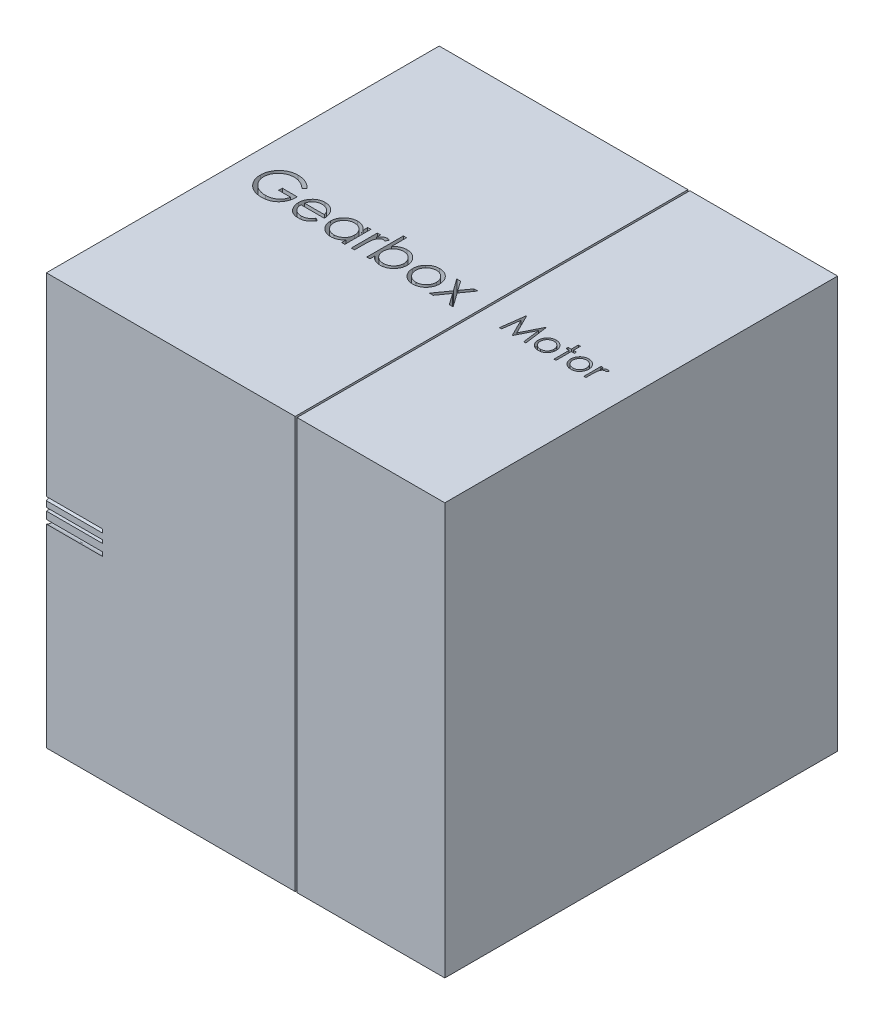
from build123d import *

# Parameters (mm, degrees)
BOSS_EXTRUDE1_DEPTH      = 110
BOSS_EXTRUDE1_DEPTH_BACK = 110
SKETCH1_W                = 213
SKETCH1_H                = 210
CUT_EXTRUDE1_DEPTH       = 30
SKETCH3_W                = 1.709615384
SKETCH3_H                = 19.538461539
SKETCH3_W_2              = 1.709615385
SKETCH3_H_2              = 13.921153846
CUT_EXTRUDE2_DEPTH       = 30
CUT_EXTRUDE3_DEPTH       = 267.021145938
CUT_EXTRUDE3_DEPTH_BACK  = 267.021145938
SKETCH4_W                = 1
SKETCH4_H                = 210
CUT_EXTRUDE4_DEPTH       = 30


with BuildPart() as part:
    # Sketch1 → Boss-Extrude1 (new, two sides: drawn at the far end of the back side and taken through both)
    with BuildSketch(Plane(origin=(0, 0, 0), x_dir=(1, 0, 0), z_dir=(0, 1, 0)).offset(-BOSS_EXTRUDE1_DEPTH_BACK)):
        Rectangle(SKETCH1_W, SKETCH1_H)
    extrude(amount=BOSS_EXTRUDE1_DEPTH + BOSS_EXTRUDE1_DEPTH_BACK)

    # Sketch2 → Cut-Extrude1 (cut)
    # profile 1 of 7: a face of its own
    with BuildSketch(Plane(origin=(0, 110, 0), x_dir=(1, 0, 0), z_dir=(0, 1, 0))):
        with BuildLine():
            Line((-75.784684127, 3.745099252), (-77.250068742, 2.356036752))
            add(Edge.make_bspline(
                [(-77.250068742, 2.356036752), (-77.51523869, 2.605487592), (-78.039255458, 3.098440974), (-78.893567636, 3.738036533), (-79.784909701, 4.285947736), (-80.708630577, 4.73175168), (-81.641854992, 5.087457419), (-82.572195902, 5.340703439), (-83.490110363, 5.502206822), (-84.100620509, 5.521520089), (-84.401450954, 5.531036752)],
                knots=[0, 0, 0, 0, 1.08915593, 2.152340314, 3.188132944, 4.216796309, 5.218260357, 6.173443236, 7.099959455, 8, 8, 8, 8], degree=3))
            add(Edge.make_bspline(
                [(-84.401450954, 5.531036752), (-84.586043821, 5.528785554), (-84.954750804, 5.524288997), (-85.502421671, 5.466898339), (-86.044348653, 5.384358151), (-86.579508736, 5.264931645), (-87.108942451, 5.113570907), (-87.63080845, 4.9242386), (-88.146080224, 4.703502199), (-88.649904179, 4.448436449), (-89.13834892, 4.168238999), (-89.599668268, 3.857731943), (-90.036802625, 3.526867244), (-90.441535797, 3.167361198), (-90.816195885, 2.782470288), (-91.169700595, 2.379354293), (-91.48961702, 1.946999747), (-91.778584646, 1.493361411), (-92.036367169, 1.02640678), (-92.263925698, 0.550630365), (-92.454954134, 0.067610243), (-92.606099312, -0.423259693), (-92.730798729, -0.918181904), (-92.818524562, -1.420583311), (-92.867982293, -1.931001856), (-92.876537267, -2.272798363), (-92.880837973, -2.444624306)],
                knots=[0, 0, 0, 0, 1.02818874, 2.053710826, 3.065248034, 4.081641283, 5.106893873, 6.131558223, 7.173050175, 8.228653731, 9.27666206, 10.308777013, 11.325269123, 12.329503258, 13.32196095, 14.316845687, 15.314881793, 16.315733098, 17.311955233, 18.285320748, 19.252783886, 20.203351036, 21.145449891, 22.095197417, 23.042428769, 24, 24, 24, 24], degree=3))
            add(Edge.make_bspline(
                [(-92.880837973, -2.444624306), (-92.876724706, -2.620269754), (-92.868509405, -2.971081021), (-92.815929666, -3.494651616), (-92.718348814, -4.010446164), (-92.587895999, -4.520159573), (-92.424714702, -5.024664794), (-92.22130062, -5.521774598), (-91.98036928, -6.011470584), (-91.701496047, -6.489340471), (-91.395682568, -6.954830069), (-91.05309237, -7.393304038), (-90.689179766, -7.81060124), (-90.290686968, -8.197456468), (-89.870392031, -8.564217389), (-89.415737786, -8.900779302), (-88.935664394, -9.21362506), (-88.429439426, -9.49881183), (-87.90255571, -9.753584002), (-87.362315383, -9.980136923), (-86.806992558, -10.166714459), (-86.239505633, -10.318777568), (-85.660531111, -10.443420614), (-85.067130128, -10.5236074), (-84.463665815, -10.581796065), (-84.056874118, -10.586050584), (-83.851931723, -10.588194018)],
                knots=[0, 0, 0, 0, 0.93586088, 1.869166235, 2.799637598, 3.729985548, 4.670839027, 5.622275134, 6.589130586, 7.576015415, 8.568469353, 9.55398029, 10.53834874, 11.515998671, 12.510579167, 13.508179873, 14.527009472, 15.561807829, 16.601455013, 17.643573243, 18.680854198, 19.719860599, 20.772568776, 21.833555941, 22.908541556, 24, 24, 24, 24], degree=3))
            add(Edge.make_bspline(
                [(-83.851931723, -10.588194018), (-83.604943862, -10.583031052), (-83.119943069, -10.572892731), (-82.407002573, -10.493969727), (-81.722274431, -10.370706465), (-81.067682668, -10.190189227), (-80.442466998, -9.959936367), (-79.844335417, -9.682375764), (-79.277997104, -9.3468614), (-78.741749545, -8.96818078), (-78.24777115, -8.54627862), (-77.802250846, -8.0910138), (-77.412294683, -7.60459618), (-77.072090534, -7.089890678), (-76.790647715, -6.542636947), (-76.559637645, -5.965516857), (-76.382563586, -5.358270828), (-76.309874366, -4.938672089), (-76.273145665, -4.726655556)],
                knots=[0, 0, 0, 0, 1.13008108, 2.219097802, 3.278683437, 4.311054135, 5.322181354, 6.324827112, 7.324222904, 8.330512327, 9.32562643, 10.293043162, 11.24128371, 12.174520618, 13.111833804, 14.052305215, 15.015860969, 16, 16, 16, 16], degree=3))
            Line((-76.273145665, -4.726655556), (-82.623145665, -4.726655556))
            Line((-82.623145665, -4.726655556), (-82.623145665, -2.772809402))
            Line((-82.623145665, -2.772809402), (-74.563530281, -2.772809402))
            add(Edge.make_bspline(
                [(-74.563530281, -2.772809402), (-74.57281497, -3.136977306), (-74.590986783, -3.849719676), (-74.718452596, -4.889143579), (-74.92428247, -5.870880938), (-75.205462167, -6.795965657), (-75.569454764, -7.663086783), (-76.012353812, -8.473124711), (-76.541247785, -9.22084636), (-77.137297474, -9.912355937), (-77.806224387, -10.529190649), (-78.52995359, -11.07133154), (-79.309680803, -11.528001489), (-80.14466847, -11.899534523), (-81.032183115, -12.189497267), (-81.974278439, -12.395082563), (-82.969676866, -12.51825422), (-83.651866493, -12.533991585), (-84.000759848, -12.542040172)],
                knots=[0, 0, 0, 0, 1.140356446, 2.231883559, 3.274166699, 4.278491846, 5.25512956, 6.21435461, 7.1637429, 8.11826594, 9.068280886, 10.0076534, 10.945064095, 11.891975133, 12.864533718, 13.863980011, 14.907571808, 16, 16, 16, 16], degree=3))
            add(Edge.make_bspline(
                [(-84.000759848, -12.542040172), (-84.215807871, -12.538942526), (-84.63995188, -12.532832971), (-85.26637536, -12.489413408), (-85.87552698, -12.422571986), (-86.467318, -12.321633528), (-87.043925262, -12.19800091), (-87.602469003, -12.039686055), (-88.145076914, -11.856432135), (-88.672587664, -11.647994255), (-89.180213269, -11.406485666), (-89.67021474, -11.138100343), (-90.145300652, -10.844222193), (-90.60223485, -10.519768876), (-91.043398133, -10.1671672), (-91.465945876, -9.785710441), (-91.872243612, -9.376564775), (-92.126754135, -9.086030451), (-92.254996627, -8.939636325)],
                knots=[0, 0, 0, 0, 1.107784379, 2.184907829, 3.233506516, 4.263428166, 5.276301166, 6.270063455, 7.25232949, 8.225834625, 9.190232166, 10.146266622, 11.1027726, 12.066435141, 13.031522626, 14.010570082, 14.99756817, 16, 16, 16, 16], degree=3))
            add(Edge.make_bspline(
                [(-92.254996627, -8.939636325), (-92.441065771, -8.707386057), (-92.810115502, -8.246740635), (-93.285158041, -7.508689509), (-93.690114247, -6.744502241), (-94.018687679, -5.952051478), (-94.275253549, -5.132078448), (-94.459256153, -4.285630935), (-94.567064399, -3.411618946), (-94.582595796, -2.820169434), (-94.590453358, -2.520946422)],
                knots=[0, 0, 0, 0, 1.023165419, 2.029347347, 3.013907458, 3.994755782, 4.975994455, 5.96558838, 6.970761222, 8, 8, 8, 8], degree=3))
            add(Edge.make_bspline(
                [(-94.590453358, -2.520946422), (-94.587556462, -2.296884389), (-94.581799487, -1.851608016), (-94.511992035, -1.190533242), (-94.411835745, -0.541196618), (-94.264622491, 0.095871067), (-94.079041393, 0.721095288), (-93.847428848, 1.334766348), (-93.577763057, 1.937246393), (-93.264333428, 2.524388445), (-92.91553087, 3.088401321), (-92.536978956, 3.627014508), (-92.123302218, 4.130419276), (-91.681256223, 4.604990961), (-91.205566891, 5.044767543), (-90.700690599, 5.453820631), (-90.166238262, 5.832698928), (-89.600528482, 6.175434743), (-89.012004942, 6.483302448), (-88.402078363, 6.753209444), (-87.770934931, 6.976275775), (-87.123303088, 7.16554449), (-86.454280692, 7.305508326), (-85.768722698, 7.407010783), (-85.06305566, 7.476464904), (-84.586065272, 7.482050668), (-84.344209367, 7.484882905)],
                knots=[0, 0, 0, 0, 1.008945113, 2.00506715, 2.99143336, 3.967273523, 4.948097931, 5.927297278, 6.919902385, 7.919676788, 8.923139349, 9.905703106, 10.883022732, 11.856032218, 12.825136022, 13.798837087, 14.781400844, 15.773989409, 16.776158564, 17.77167057, 18.775803737, 19.789618931, 20.80898985, 21.851988756, 22.910860228, 24, 24, 24, 24], degree=3))
            add(Edge.make_bspline(
                [(-84.344209367, 7.484882905), (-84.146969784, 7.481728815), (-83.755866868, 7.475474623), (-83.173885382, 7.432124182), (-82.600899403, 7.3634142), (-82.036059338, 7.269651262), (-81.481288687, 7.141941746), (-80.935007048, 6.989115654), (-80.396422529, 6.811178734), (-79.867223059, 6.598968013), (-79.343850347, 6.358101855), (-78.82339433, 6.086974513), (-78.307633291, 5.780949845), (-77.795672806, 5.439119173), (-77.284284494, 5.067353427), (-76.78155694, 4.655019858), (-76.275355201, 4.218378859), (-75.949862469, 3.904422972), (-75.784684127, 3.745099252)],
                knots=[0, 0, 0, 0, 0.985871117, 1.954866573, 2.915460327, 3.869826059, 4.81536089, 5.759505086, 6.70452669, 7.649098992, 8.607881297, 9.583363685, 10.581137262, 11.603961102, 12.659522466, 13.73993555, 14.853081303, 16, 16, 16, 16], degree=3))
        make_face()
    # profile 2 of 7: a face of its own
    with BuildSketch(Plane(origin=(0, 110, 0), x_dir=(1, 0, 0), z_dir=(0, 1, 0))):
        with BuildLine():
            Line((-59.718878838, -7.657424787), (-58.200068742, -8.454990893))
            add(Edge.make_bspline(
                [(-58.200068742, -8.454990893), (-58.321099354, -8.66967531), (-58.556576994, -9.08736617), (-58.961529636, -9.661216725), (-59.386029345, -10.177459292), (-59.849238086, -10.622302125), (-60.337297338, -11.010113234), (-60.852913645, -11.349409109), (-61.398771353, -11.638525627), (-61.974896283, -11.882107243), (-62.586126697, -12.069393204), (-63.233943808, -12.201677606), (-63.919588662, -12.283447111), (-64.389558584, -12.292945663), (-64.630206963, -12.297809402)],
                knots=[0, 0, 0, 0, 1.120438281, 2.179929193, 3.190490725, 4.156257408, 5.095198341, 6.022838206, 6.959905092, 7.901321166, 8.864066838, 9.862729781, 10.905609505, 12, 12, 12, 12], degree=3))
            add(Edge.make_bspline(
                [(-64.630206963, -12.297809402), (-64.897679727, -12.291565491), (-65.419441601, -12.279385429), (-66.17893651, -12.174379301), (-66.894015916, -12.003079748), (-67.564639616, -11.763781587), (-68.189165305, -11.451212866), (-68.768834243, -11.0704334), (-69.306694805, -10.623399271), (-69.785798001, -10.106238343), (-70.217111134, -9.552797976), (-70.597707383, -8.976095233), (-70.915882829, -8.377581111), (-71.174704893, -7.76106583), (-71.383737087, -7.13043521), (-71.529424432, -6.479951365), (-71.613406346, -5.811374828), (-71.626275685, -5.359087901), (-71.63276105, -5.131162768)],
                knots=[0, 0, 0, 0, 1.145258523, 2.234067595, 3.276747158, 4.290159414, 5.277019952, 6.260822364, 7.254936242, 8.264827045, 9.274100331, 10.257902744, 11.220704747, 12.172965371, 13.118907548, 14.062713208, 15.023725156, 16, 16, 16, 16], degree=3))
            add(Edge.make_bspline(
                [(-71.63276105, -5.131162768), (-71.626996295, -4.917286619), (-71.615571312, -4.493412337), (-71.543558026, -3.866038445), (-71.415932317, -3.256283582), (-71.240801182, -2.663641086), (-71.014643685, -2.089103243), (-70.737971178, -1.532320382), (-70.410352664, -0.993884978), (-70.15740854, -0.654233636), (-70.029996627, -0.483145941)],
                knots=[0, 0, 0, 0, 1.024358464, 2.0301432, 3.019427413, 4.004406732, 4.986367066, 5.972626655, 6.978780325, 8, 8, 8, 8], degree=3))
            add(Edge.make_bspline(
                [(-70.029996627, -0.483145941), (-69.857416239, -0.277031091), (-69.517722373, 0.128669414), (-68.94319421, 0.66173373), (-68.32107457, 1.108286278), (-67.659159862, 1.478439404), (-66.949757053, 1.759691683), (-66.202402198, 1.969282952), (-65.408585507, 2.086728983), (-64.865904234, 2.103317906), (-64.5882298, 2.111805982)],
                knots=[0, 0, 0, 0, 1.030682036, 2.02871468, 2.997146059, 3.962720338, 4.930598197, 5.918074684, 6.934738563, 8, 8, 8, 8], degree=3))
            add(Edge.make_bspline(
                [(-64.5882298, 2.111805982), (-64.302764977, 2.104436088), (-63.742748067, 2.089978034), (-62.926144665, 1.95594042), (-62.153472765, 1.743382944), (-61.425041563, 1.443188741), (-60.740777207, 1.055877467), (-60.105127423, 0.576134015), (-59.507221333, 0.018686998), (-59.159376068, -0.410009899), (-58.982370425, -0.62815796)],
                knots=[0, 0, 0, 0, 1.056321875, 2.072262726, 3.055038591, 4.01806755, 4.982017516, 5.957941055, 6.960871419, 8, 8, 8, 8], degree=3))
            add(Edge.make_bspline(
                [(-58.982370425, -0.62815796), (-58.861936661, -0.792551739), (-58.621870775, -1.120245042), (-58.321168702, -1.654576626), (-58.060143453, -2.213615718), (-57.851502622, -2.806398906), (-57.682559051, -3.425902621), (-57.560329795, -4.076555614), (-57.488649442, -4.758164132), (-57.474559532, -5.222584384), (-57.467376435, -5.459347864)],
                knots=[0, 0, 0, 0, 0.94817472, 1.890038105, 2.849395472, 3.817997239, 4.812318967, 5.836947057, 6.897266129, 8, 8, 8, 8], degree=3))
            Line((-57.467376435, -5.459347864), (-69.923145665, -5.459347864))
            add(Edge.make_bspline(
                [(-69.923145665, -5.459347864), (-69.914765808, -5.642774676), (-69.898287155, -6.003476105), (-69.821460447, -6.531274225), (-69.70036355, -7.03404913), (-69.530170509, -7.508029687), (-69.32406668, -7.959406524), (-69.07159585, -8.384831325), (-68.770390563, -8.782366344), (-68.4344264, -9.155567479), (-68.060463495, -9.487912479), (-67.667038828, -9.78537429), (-67.248518139, -10.034687609), (-66.808201427, -10.237052438), (-66.346800711, -10.395473958), (-65.86417062, -10.503611668), (-65.361260873, -10.576040349), (-65.01843852, -10.584093956), (-64.843908887, -10.588194018)],
                knots=[0, 0, 0, 0, 1.094153842, 2.151609401, 3.174256925, 4.172055639, 5.149267565, 6.128595816, 7.11444997, 8.118368179, 9.117203808, 10.09244225, 11.054858984, 12.015122123, 12.976791628, 13.957293641, 14.960065497, 16, 16, 16, 16], degree=3))
            add(Edge.make_bspline(
                [(-64.843908887, -10.588194018), (-64.673269069, -10.584884452), (-64.334686937, -10.578317639), (-63.830455985, -10.514462524), (-63.334396557, -10.411210024), (-62.848561777, -10.270294507), (-62.382811887, -10.098426212), (-61.951489679, -9.891037801), (-61.554813076, -9.66162275), (-61.184062158, -9.399224376), (-60.82444718, -9.078051244), (-60.46770879, -8.677262534), (-60.085203005, -8.203257562), (-59.845773936, -7.846501865), (-59.718878838, -7.657424787)],
                knots=[0, 0, 0, 0, 0.99110716, 1.966546729, 2.947904876, 3.932708344, 4.903319531, 5.828989031, 6.710028674, 7.56322171, 8.463672341, 9.504779593, 10.677557249, 12, 12, 12, 12], degree=3))
        make_face()
        with BuildLine():
            add(Edge.make_bspline(
                [(-59.176991819, -3.749732479), (-59.239566304, -3.522967409), (-59.360002045, -3.086517646), (-59.611659972, -2.482137942), (-59.895077929, -1.944993795), (-60.23047621, -1.479196078), (-60.610489559, -1.065519815), (-61.049429768, -0.704012944), (-61.541659416, -0.380612246), (-62.084634168, -0.107639356), (-62.659627312, 0.124715446), (-63.261641014, 0.280517862), (-63.875909831, 0.387249799), (-64.291386447, 0.397189047), (-64.500459367, 0.402190598)],
                knots=[0, 0, 0, 0, 1.154881502, 2.222775134, 3.210006277, 4.132804581, 5.035138423, 5.962687519, 6.919655026, 7.923214229, 8.944639381, 9.960483929, 10.97369054, 12, 12, 12, 12], degree=3))
            add(Edge.make_bspline(
                [(-64.500459367, 0.402190598), (-64.671089883, 0.398861357), (-65.008390538, 0.392280148), (-65.505329209, 0.329849872), (-65.982557285, 0.226654145), (-66.443596065, 0.085330596), (-66.882403934, -0.103039084), (-67.308006887, -0.323927788), (-67.709583043, -0.593575552), (-67.960723523, -0.799091604), (-68.08759879, -0.902917575)],
                knots=[0, 0, 0, 0, 1.04873581, 2.073130211, 3.073294108, 4.04793562, 5.032784715, 6.005352987, 6.992311501, 8, 8, 8, 8], degree=3))
            add(Edge.make_bspline(
                [(-68.08759879, -0.902917575), (-68.178457939, -0.985073779), (-68.362334713, -1.151337912), (-68.608028123, -1.437791165), (-68.843270981, -1.74668181), (-69.057358434, -2.089827417), (-69.253723583, -2.463320514), (-69.437474316, -2.864010786), (-69.602863216, -3.294938824), (-69.695914901, -3.595234529), (-69.743788694, -3.749732479)],
                knots=[0, 0, 0, 0, 0.879870761, 1.780643979, 2.707998968, 3.669668524, 4.684282772, 5.740141944, 6.837334558, 8, 8, 8, 8], degree=3))
            Line((-69.743788694, -3.749732479), (-59.176991819, -3.749732479))
        make_face(mode=Mode.SUBTRACT)
    # profile 3 of 7: a face of its own
    with BuildSketch(Plane(origin=(0, 110, 0), x_dir=(1, 0, 0), z_dir=(0, 1, 0))):
        with BuildLine():
            Line((-39.88276105, 1.867575213), (-39.88276105, -12.053578633))
            Line((-39.88276105, -12.053578633), (-41.592376435, -12.053578633))
            Line((-41.592376435, -12.053578633), (-41.592376435, -9.645615893))
            add(Edge.make_bspline(
                [(-41.592376435, -9.645615893), (-41.785155852, -9.863545683), (-42.16136731, -10.288838408), (-42.789696823, -10.84445709), (-43.455729334, -11.30371624), (-44.156232239, -11.674646495), (-44.890572964, -11.953277545), (-45.657123667, -12.151322211), (-46.45619704, -12.278651514), (-47.001856286, -12.291366147), (-47.278374031, -12.297809402)],
                knots=[0, 0, 0, 0, 1.074387032, 2.096679803, 3.090159297, 4.057316773, 5.018401886, 5.985159533, 6.978961417, 8, 8, 8, 8], degree=3))
            add(Edge.make_bspline(
                [(-47.278374031, -12.297809402), (-47.524216751, -12.291134433), (-48.00902948, -12.277971099), (-48.722202029, -12.17585056), (-49.408504129, -12.011853891), (-50.068584303, -11.783793336), (-50.698171266, -11.481274864), (-51.302655507, -11.119100356), (-51.878905445, -10.687803838), (-52.418137678, -10.194746141), (-52.914700423, -9.659196282), (-53.350462493, -9.087992663), (-53.71378997, -8.483605266), (-54.017610695, -7.853686243), (-54.251633656, -7.193386466), (-54.414775865, -6.504989309), (-54.516777439, -5.789308712), (-54.529935332, -5.301957879), (-54.536607204, -5.054840652)],
                knots=[0, 0, 0, 0, 1.033919861, 2.038935746, 3.024066025, 3.998881131, 4.97069526, 5.957263378, 6.95902576, 7.993208707, 9.027059324, 10.027763471, 11.009749337, 11.988697705, 12.965288445, 13.950418724, 14.960734635, 16, 16, 16, 16], degree=3))
            add(Edge.make_bspline(
                [(-54.536607204, -5.054840652), (-54.52978746, -4.812831066), (-54.516305193, -4.334391169), (-54.415866954, -3.630745684), (-54.246969607, -2.953010579), (-54.009944893, -2.303367788), (-53.706005109, -1.681031229), (-53.336282236, -1.08556075), (-52.900749571, -0.515315887), (-52.398632899, 0.016294648), (-51.854702221, 0.507352562), (-51.272813272, 0.934121795), (-50.66744084, 1.30269493), (-50.029195026, 1.594723136), (-49.367522641, 1.830992691), (-48.676533172, 1.994457846), (-47.95910158, 2.090781837), (-47.472017616, 2.104730597), (-47.22494855, 2.111805982)],
                knots=[0, 0, 0, 0, 1.020392517, 2.01726096, 2.990465484, 3.961182959, 4.928053699, 5.906110375, 6.912531644, 7.948652711, 8.985773172, 9.998621852, 10.987621588, 11.969261332, 12.953316658, 13.946091881, 14.958173133, 16, 16, 16, 16], degree=3))
            add(Edge.make_bspline(
                [(-47.22494855, 2.111805982), (-46.940832174, 2.103980506), (-46.383693371, 2.088635116), (-45.568745206, 1.960930843), (-44.797794548, 1.745184329), (-44.064890146, 1.45171909), (-43.37266384, 1.061745293), (-42.727669025, 0.569820077), (-42.123155466, -0.020954098), (-41.772742736, -0.474727517), (-41.592376435, -0.708296181)],
                knots=[0, 0, 0, 0, 1.038897134, 2.037228247, 3.008116434, 3.962042015, 4.918381754, 5.904844433, 6.921570401, 8, 8, 8, 8], degree=3))
            Line((-41.592376435, -0.708296181), (-41.592376435, 1.867575213))
            Line((-41.592376435, 1.867575213), (-39.88276105, 1.867575213))
        make_face()
        with BuildLine():
            add(Edge.make_bspline(
                [(-47.202051915, 0.402190598), (-47.451957097, 0.393298941), (-47.945230177, 0.375748225), (-48.669369674, 0.238732487), (-49.362318399, 0.010760623), (-50.020610603, -0.301016582), (-50.633847611, -0.693058706), (-51.181908877, -1.167247949), (-51.669277008, -1.710646555), (-52.079169132, -2.320802327), (-52.413308837, -2.974914508), (-52.648260825, -3.658670378), (-52.803214872, -4.359737471), (-52.819045533, -4.835240089), (-52.826991819, -5.073921181)],
                knots=[0, 0, 0, 0, 1.031046209, 2.035121221, 3.029706178, 4.034933723, 5.034054252, 6.02443088, 7.017295772, 8.038157696, 9.050218397, 10.03989886, 11.016116709, 12, 12, 12, 12], degree=3))
            add(Edge.make_bspline(
                [(-52.826991819, -5.073921181), (-52.816841471, -5.311175907), (-52.796580562, -5.784755401), (-52.650980353, -6.486778255), (-52.406705614, -7.170695255), (-52.073373815, -7.83070152), (-51.655979472, -8.443480695), (-51.172171235, -8.997237648), (-50.617270418, -9.473430978), (-50.002622129, -9.872052629), (-49.346170176, -10.194065778), (-48.655831206, -10.418124473), (-47.944582376, -10.562783536), (-47.460971816, -10.57968076), (-47.217316338, -10.588194018)],
                knots=[0, 0, 0, 0, 0.979072187, 1.954306742, 2.945804271, 3.96968567, 4.997920485, 5.998718438, 6.996577872, 8.005894225, 9.015743152, 10.005417472, 10.995077863, 12, 12, 12, 12], degree=3))
            add(Edge.make_bspline(
                [(-47.217316338, -10.588194018), (-46.969957516, -10.579159071), (-46.477985352, -10.561189459), (-45.751697528, -10.423587143), (-45.046874945, -10.196245541), (-44.373118745, -9.881108865), (-43.745469517, -9.490543828), (-43.182145354, -9.033305233), (-42.705808441, -8.501520759), (-42.301988666, -7.917086065), (-41.985348183, -7.276396484), (-41.754701347, -6.594220389), (-41.618336517, -5.870534031), (-41.601149445, -5.375974657), (-41.592376435, -5.123530556)],
                knots=[0, 0, 0, 0, 1.01762866, 2.023962475, 3.030623092, 4.058876274, 5.077231937, 6.066672613, 7.034107872, 8.005628644, 8.981990164, 9.965428785, 10.961468474, 12, 12, 12, 12], degree=3))
            add(Edge.make_bspline(
                [(-41.592376435, -5.123530556), (-41.597599707, -4.931191793), (-41.60788076, -4.55260824), (-41.686424289, -3.996742752), (-41.811364674, -3.464792043), (-41.987420257, -2.956196835), (-42.218694247, -2.473769108), (-42.497628516, -2.014044928), (-42.829128178, -1.579415306), (-43.207856853, -1.175865162), (-43.622413169, -0.807783989), (-44.061077741, -0.479230051), (-44.529047778, -0.209325445), (-45.018453364, 0.014056333), (-45.530143627, 0.19181542), (-46.068282287, 0.310402725), (-46.627149344, 0.391829615), (-47.008400017, 0.398700573), (-47.202051915, 0.402190598)],
                knots=[0, 0, 0, 0, 1.050140795, 2.067009409, 3.05949893, 4.030605086, 5.00011959, 5.97591094, 6.962425594, 7.979863591, 8.993523472, 9.986985069, 10.967611495, 11.937549037, 12.921786183, 13.919465291, 14.943216303, 16, 16, 16, 16], degree=3))
        make_face(mode=Mode.SUBTRACT)
    # profile 4 of 7: a face of its own
    with BuildSketch(Plane(origin=(0, 110, 0), x_dir=(1, 0, 0), z_dir=(0, 1, 0))):
        with BuildLine():
            Line((-36.463530281, 1.867575213), (-34.753914896, 1.867575213))
            Line((-34.753914896, 1.867575213), (-34.753914896, -0.181673585))
            add(Edge.make_bspline(
                [(-34.753914896, -0.181673585), (-34.627701795, 0.009130281), (-34.38632022, 0.374041191), (-33.985111275, 0.856655529), (-33.57415743, 1.25624314), (-33.151491339, 1.574669435), (-32.714004823, 1.813137982), (-32.271299415, 1.987815787), (-31.816410072, 2.091106603), (-31.510728741, 2.104896946), (-31.357580762, 2.111805982)],
                knots=[0, 0, 0, 0, 1.2804753, 2.448899062, 3.506932113, 4.484331642, 5.4025378, 6.288909075, 7.142734305, 8, 8, 8, 8], degree=3))
            add(Edge.make_bspline(
                [(-31.357580762, 2.111805982), (-31.238783184, 2.105326116), (-30.994349449, 2.09199337), (-30.624329925, 1.99831731), (-30.243093422, 1.848758359), (-29.997389857, 1.708113719), (-29.869299512, 1.634792761)],
                knots=[0, 0, 0, 0, 0.901110191, 1.854092781, 2.881294221, 4, 4, 4, 4], degree=3))
            Line((-29.869299512, 1.634792761), (-30.808061531, 0.154143723))
            add(Edge.make_bspline(
                [(-30.808061531, 0.154143723), (-30.890297774, 0.190830028), (-31.046397908, 0.260467659), (-31.274750618, 0.342883457), (-31.485287608, 0.391411514), (-31.619418976, 0.398763276), (-31.681949752, 0.402190598)],
                knots=[0, 0, 0, 0, 1.180555205, 2.24091978, 3.179933427, 4, 4, 4, 4], degree=3))
            add(Edge.make_bspline(
                [(-31.681949752, 0.402190598), (-31.819140959, 0.393046394), (-32.098971253, 0.37439487), (-32.509822599, 0.227770788), (-32.908496675, -0.009130876), (-33.225116723, -0.271863642), (-33.470275271, -0.525216654), (-33.645209927, -0.746460102), (-33.805680307, -0.994538083), (-33.959006792, -1.265209647), (-34.098704765, -1.563096381), (-34.229086607, -1.885222157), (-34.346972704, -2.231960072), (-34.414193319, -2.473527789), (-34.448626435, -2.597268537)],
                knots=[0, 0, 0, 0, 1.125678352, 2.296057538, 3.5422874, 4.923748041, 5.663163013, 6.437101912, 7.23742474, 8.08941207, 8.991984279, 9.93940061, 10.944477711, 12, 12, 12, 12], degree=3))
            add(Edge.make_bspline(
                [(-34.448626435, -2.597268537), (-34.474384176, -2.707634296), (-34.531435615, -2.952086066), (-34.586906699, -3.362197322), (-34.641713647, -3.846740379), (-34.680339527, -4.407063977), (-34.716142871, -5.04176885), (-34.736336318, -5.751821926), (-34.753226269, -6.537952023), (-34.75367839, -7.087541003), (-34.753914896, -7.37503296)],
                knots=[0, 0, 0, 0, 0.566838948, 1.255505196, 2.06880316, 3.007127437, 4.065329342, 5.249902469, 6.561414163, 8, 8, 8, 8], degree=3))
            Line((-34.753914896, -7.37503296), (-34.753914896, -12.053578633))
            Line((-34.753914896, -12.053578633), (-36.463530281, -12.053578633))
            Line((-36.463530281, -12.053578633), (-36.463530281, 1.867575213))
        make_face()
    # profile 5 of 7: a face of its own
    with BuildSketch(Plane(origin=(0, 110, 0), x_dir=(1, 0, 0), z_dir=(0, 1, 0))):
        with BuildLine():
            Line((-28.159684127, -12.053578633), (-28.159684127, 7.484882905))
            Line((-28.159684127, 7.484882905), (-26.450068742, 7.484882905))
            Line((-26.450068742, 7.484882905), (-26.450068742, -0.658686806))
            add(Edge.make_bspline(
                [(-26.450068742, -0.658686806), (-26.257427419, -0.436847205), (-25.881576256, -0.004029), (-25.251421571, 0.561198923), (-24.5906284, 1.040455978), (-23.894169893, 1.435531852), (-23.1610555, 1.736378198), (-22.395070737, 1.956391492), (-21.594257501, 2.089125921), (-21.048234569, 2.104181263), (-20.771703358, 2.111805982)],
                knots=[0, 0, 0, 0, 1.077089805, 2.101446609, 3.097517232, 4.067117542, 5.031729543, 5.997785507, 6.985986182, 8, 8, 8, 8], degree=3))
            add(Edge.make_bspline(
                [(-20.771703358, 2.111805982), (-20.525870522, 2.105055597), (-20.039817109, 2.091708936), (-19.325267137, 1.99028404), (-18.637762025, 1.825812861), (-17.977675999, 1.597799714), (-17.348089106, 1.295269508), (-16.743610524, 0.933094676), (-16.167337223, 0.50181177), (-15.628195632, 0.008698107), (-15.131296051, -0.526642939), (-14.696343675, -1.099124369), (-14.328952471, -1.700424504), (-14.025070721, -2.328530559), (-13.790096848, -2.986007841), (-13.628213936, -3.672211693), (-13.52537951, -4.386467052), (-13.512424169, -4.872583883), (-13.505837973, -5.11971445)],
                knots=[0, 0, 0, 0, 1.034377878, 2.045141349, 3.03070803, 4.00595497, 4.978199603, 5.965204761, 6.967410914, 8.002051993, 9.036360596, 10.037508045, 11.022711142, 11.997267194, 12.969246472, 13.954813154, 14.960274251, 16, 16, 16, 16], degree=3))
            add(Edge.make_bspline(
                [(-13.505837973, -5.11971445), (-13.512567742, -5.363010261), (-13.525837787, -5.842751284), (-13.627190907, -6.548725541), (-13.794538433, -7.228204746), (-14.033812874, -7.879433117), (-14.33461204, -8.505470074), (-14.710774841, -9.099179131), (-15.145174709, -9.67089127), (-15.64771996, -10.20224275), (-16.191535155, -10.693370256), (-16.773454106, -11.120122179), (-17.378819136, -11.488696789), (-18.017065504, -11.780735726), (-18.678742987, -12.01696074), (-19.37094045, -12.180887029), (-20.089741734, -12.276534657), (-20.578068826, -12.290661957), (-20.825128838, -12.297809402)],
                knots=[0, 0, 0, 0, 1.024244038, 2.01964794, 2.996620209, 3.965911562, 4.936179293, 5.91563013, 6.920572822, 7.955171681, 8.990768464, 10.002129126, 10.989675881, 11.969873457, 12.952483066, 13.943799762, 14.959703725, 16, 16, 16, 16], degree=3))
            add(Edge.make_bspline(
                [(-20.825128838, -12.297809402), (-21.107967521, -12.289968377), (-21.662564862, -12.274593495), (-22.473837224, -12.147127336), (-23.241723944, -11.930166287), (-23.974972315, -11.638637302), (-24.663100349, -11.243874199), (-25.310476948, -10.754252458), (-25.913019591, -10.161704187), (-26.2679854, -9.709612364), (-26.450068742, -9.477707239)],
                knots=[0, 0, 0, 0, 1.035807596, 2.031038093, 2.998900396, 3.954262848, 4.914341711, 5.895762244, 6.92060972, 8, 8, 8, 8], degree=3))
            Line((-26.450068742, -9.477707239), (-26.450068742, -12.053578633))
            Line((-26.450068742, -12.053578633), (-28.159684127, -12.053578633))
        make_face()
        with BuildLine():
            add(Edge.make_bspline(
                [(-20.840393262, -10.588194018), (-20.590488, -10.579302409), (-20.097214763, -10.561751788), (-19.373076418, -10.424735354), (-18.680123363, -10.196766105), (-18.021847444, -9.884979064), (-17.408550046, -9.492973418), (-16.860712138, -9.018649261), (-16.373686862, -8.477076732), (-15.96736791, -7.866204773), (-15.628135065, -7.216050211), (-15.395108518, -6.5321318), (-15.238791179, -5.832753019), (-15.223266526, -5.358429549), (-15.215453358, -5.11971445)],
                knots=[0, 0, 0, 0, 1.031910345, 2.036826888, 3.032245421, 4.038315463, 5.03827337, 6.029480047, 7.023177075, 8.037597977, 9.052889626, 10.043399556, 11.015292101, 12, 12, 12, 12], degree=3))
            add(Edge.make_bspline(
                [(-15.215453358, -5.11971445), (-15.225728078, -4.881232715), (-15.246236499, -4.405221325), (-15.389790673, -3.699556708), (-15.640476644, -3.016001208), (-15.973133313, -2.356446728), (-16.386071919, -1.741361414), (-16.870518663, -1.188965151), (-17.425046779, -0.712388665), (-18.039128533, -0.315114134), (-18.693252143, 0.009060004), (-19.381722591, 0.231373642), (-20.09015466, 0.376905776), (-20.571278699, 0.393719461), (-20.813680521, 0.402190598)],
                knots=[0, 0, 0, 0, 0.984795267, 1.965658976, 2.959410029, 3.983795688, 5.009594896, 6.01088574, 7.009236619, 8.019050059, 9.024672985, 10.014834719, 10.999826153, 12, 12, 12, 12], degree=3))
            add(Edge.make_bspline(
                [(-20.813680521, 0.402190598), (-21.061153669, 0.393724247), (-21.552337652, 0.37692026), (-22.277153262, 0.23111796), (-22.985069135, 0.007701675), (-23.661548416, -0.31305324), (-24.292125489, -0.705545619), (-24.856074136, -1.166774418), (-25.342293042, -1.693533633), (-25.74258128, -2.284115211), (-26.060470257, -2.921936618), (-26.287893228, -3.602360182), (-26.423962734, -4.321804183), (-26.441260855, -4.815107773), (-26.450068742, -5.06628897)],
                knots=[0, 0, 0, 0, 1.016820015, 2.018181405, 3.029022337, 4.06341356, 5.088169224, 6.076823655, 7.05054209, 8.02560866, 9.001194327, 9.972267242, 10.967515442, 12, 12, 12, 12], degree=3))
            add(Edge.make_bspline(
                [(-26.450068742, -5.06628897), (-26.444845393, -5.258627667), (-26.434564189, -5.63721109), (-26.356021754, -6.193077521), (-26.231077367, -6.72502478), (-26.05503635, -7.233632541), (-25.823708201, -7.716013592), (-25.54497804, -8.175913684), (-25.213226936, -8.609182957), (-24.838178213, -9.0147592), (-24.424725827, -9.383836155), (-23.981007139, -9.703757637), (-23.516089544, -9.979243444), (-23.02465413, -10.198834658), (-22.512419821, -10.378049006), (-21.974130278, -10.496342679), (-21.415304384, -10.577849676), (-21.03404804, -10.584709599), (-20.840393262, -10.588194018)],
                knots=[0, 0, 0, 0, 1.050331198, 2.067384183, 3.060053655, 4.031335885, 5.001026174, 5.976994447, 6.963687968, 7.976578778, 8.990422448, 9.985569286, 10.960374351, 11.936812464, 12.921228065, 13.919088064, 14.943024695, 16, 16, 16, 16], degree=3))
        make_face(mode=Mode.SUBTRACT)
    # profile 6 of 7: a face of its own
    with BuildSketch(Plane(origin=(0, 110, 0), x_dir=(1, 0, 0), z_dir=(0, 1, 0))):
        with BuildLine():
            add(Edge.make_bspline(
                [(-3.362628838, 2.111805982), (-3.101419196, 2.106243975), (-2.589250924, 2.095338237), (-1.839182288, 1.978779639), (-1.123200906, 1.800540412), (-0.438564631, 1.554133767), (0.205958348, 1.22385058), (0.81975612, 0.829737152), (1.40114584, 0.36283475), (1.749614042, 0.001657264), (1.926493758, -0.181673585)],
                knots=[0, 0, 0, 0, 1.054011418, 2.066658804, 3.057071809, 4.030435133, 4.997543892, 5.974964718, 6.972108034, 8, 8, 8, 8], degree=3))
            add(Edge.make_bspline(
                [(1.926493758, -0.181673585), (2.078795536, -0.357009708), (2.380451634, -0.704288716), (2.76725219, -1.267382838), (3.100472396, -1.8505311), (3.367515083, -2.461477264), (3.578072141, -3.094887974), (3.727564002, -3.752940349), (3.816483605, -4.434181124), (3.828474039, -4.896844871), (3.834546642, -5.131162768)],
                knots=[0, 0, 0, 0, 1.025258237, 2.030674902, 3.01204498, 3.988269485, 4.97094183, 5.956517959, 6.965070386, 8, 8, 8, 8], degree=3))
            add(Edge.make_bspline(
                [(3.834546642, -5.131162768), (3.829205364, -5.366838796), (3.818650747, -5.832545619), (3.718809064, -6.518451024), (3.563518439, -7.183539987), (3.341276577, -7.825028021), (3.056298868, -8.444875981), (2.708550983, -9.040376528), (2.29559261, -9.612704568), (1.827485142, -10.157000287), (1.310131359, -10.658647828), (0.748884894, -11.095863124), (0.154775082, -11.470448849), (-0.480098026, -11.77218134), (-1.149936776, -12.010086994), (-1.856185961, -12.177182798), (-2.597748415, -12.278211391), (-3.104082292, -12.29118484), (-3.362628838, -12.297809402)],
                knots=[0, 0, 0, 0, 0.998656419, 1.973391657, 2.932242238, 3.890759089, 4.846373663, 5.82037756, 6.809684879, 7.83454468, 8.860553229, 9.859544525, 10.845671541, 11.83227036, 12.833544569, 13.85385346, 14.904124723, 16, 16, 16, 16], degree=3))
            add(Edge.make_bspline(
                [(-3.362628838, -12.297809402), (-3.622442097, -12.291162606), (-4.131299491, -12.278144519), (-4.875479478, -12.177575309), (-5.582994404, -12.010164004), (-6.253710062, -11.771399507), (-6.891312729, -11.470439205), (-7.488864948, -11.09699558), (-8.050567345, -10.658518164), (-8.568030575, -10.157035421), (-9.036108698, -9.612695516), (-9.449074644, -9.040378878), (-9.796820562, -8.444875369), (-10.081798786, -7.825028184), (-10.30404051, -7.183539944), (-10.459331172, -6.518451036), (-10.559172845, -5.832545616), (-10.569727463, -5.366838795), (-10.575068742, -5.131162768)],
                knots=[0, 0, 0, 0, 1.099876186, 2.154163076, 3.173186993, 4.173200201, 5.163417411, 6.152872554, 7.150605724, 8.17532212, 9.198891216, 10.186952605, 11.159729845, 12.11414092, 13.071450619, 14.029093627, 15.002601286, 16, 16, 16, 16], degree=3))
            add(Edge.make_bspline(
                [(-10.575068742, -5.131162768), (-10.568954724, -4.898118425), (-10.55685002, -4.436730678), (-10.468019821, -3.756770533), (-10.319111106, -3.099831887), (-10.108301648, -2.468866082), (-9.838797538, -1.860597209), (-9.510259671, -1.276008057), (-9.119513513, -0.715460172), (-8.819057177, -0.368629993), (-8.667015858, -0.193121902)],
                knots=[0, 0, 0, 0, 1.031353054, 2.041901799, 3.029428768, 4.008703097, 4.981709435, 5.96992636, 6.972712378, 8, 8, 8, 8], degree=3))
            add(Edge.make_bspline(
                [(-8.667015858, -0.193121902), (-8.490402812, -0.008201162), (-8.143062182, 0.355478014), (-7.558778392, 0.821019323), (-6.946490595, 1.223333954), (-6.294844925, 1.547054498), (-5.610771084, 1.801989859), (-4.891120635, 1.979239305), (-4.138506758, 2.09491828), (-3.623832249, 2.106120648), (-3.362628838, 2.111805982)],
                knots=[0, 0, 0, 0, 1.027980169, 2.021703884, 2.998553061, 3.971491411, 4.943284454, 5.930300938, 6.949603206, 8, 8, 8, 8], degree=3))
        make_face()
        with BuildLine():
            add(Edge.make_bspline(
                [(-3.37026105, 0.402190598), (-3.55497862, 0.396940463), (-3.919645306, 0.386575725), (-4.456417617, 0.307741901), (-4.973163312, 0.182841914), (-5.470862764, 0.005382694), (-5.947837602, -0.223755599), (-6.404544493, -0.505196816), (-6.842326773, -0.835213337), (-7.252620575, -1.213288735), (-7.629170017, -1.626287262), (-7.958343003, -2.06633333), (-8.238242511, -2.526289301), (-8.471415376, -3.006633478), (-8.645081643, -3.512233617), (-8.771209094, -4.03736391), (-8.849968545, -4.583094248), (-8.860235834, -4.954084933), (-8.865453358, -5.142611085)],
                knots=[0, 0, 0, 0, 1.021534396, 2.016698045, 2.994645724, 3.958388632, 4.93408049, 5.916473867, 6.921342795, 7.962252576, 8.998418191, 10.008913653, 10.997312074, 11.973003931, 12.956656626, 13.948281152, 14.957379055, 16, 16, 16, 16], degree=3))
            add(Edge.make_bspline(
                [(-8.865453358, -5.142611085), (-8.856707646, -5.386189976), (-8.839349044, -5.869648526), (-8.698187257, -6.581634779), (-8.462041934, -7.26515886), (-8.14315974, -7.916213761), (-7.743620178, -8.51858716), (-7.27288343, -9.055641953), (-6.736001632, -9.519296156), (-6.139374681, -9.904001901), (-5.495189036, -10.209671428), (-4.813436774, -10.426291567), (-4.10237814, -10.567107493), (-3.616435874, -10.581103661), (-3.37026105, -10.588194018)],
                knots=[0, 0, 0, 0, 1.016792936, 2.018143844, 3.017858371, 4.030088057, 5.03801393, 6.028138512, 7.003788237, 7.991172063, 8.984598303, 9.972568034, 10.972917682, 12, 12, 12, 12], degree=3))
            add(Edge.make_bspline(
                [(-3.37026105, -10.588194018), (-3.124100385, -10.581062349), (-2.63818607, -10.566984634), (-1.928115407, -10.427000773), (-1.248226503, -10.208722276), (-0.604709951, -9.904345677), (-0.008354581, -9.517835248), (0.532388494, -9.05826011), (0.999105934, -8.517164719), (1.39825027, -7.915415884), (1.722354684, -7.266168196), (1.957394682, -6.581508625), (2.098895828, -5.869680654), (2.116208624, -5.38620074), (2.124931258, -5.142611085)],
                knots=[0, 0, 0, 0, 1.02726834, 2.027799167, 3.010890988, 4.004497153, 4.992059811, 5.971914811, 6.958719428, 7.966827853, 8.981595046, 9.981490638, 10.983022906, 12, 12, 12, 12], degree=3))
            add(Edge.make_bspline(
                [(2.124931258, -5.142611085), (2.119715531, -4.954083807), (2.109451777, -4.583090904), (2.030666613, -4.037376692), (1.904634319, -3.512186716), (1.730617374, -3.006806527), (1.49845767, -2.525045611), (1.213160553, -2.067683811), (0.885331686, -1.624762896), (0.5042385, -1.214623794), (0.094372971, -0.835065952), (-0.343586736, -0.505068847), (-0.799616406, -0.224992505), (-1.275205548, 0.007342604), (-1.772968809, 0.181227413), (-2.28899047, 0.308463079), (-2.823472564, 0.386242578), (-3.186832499, 0.396840591), (-3.37026105, 0.402190598)],
                knots=[0, 0, 0, 0, 1.042956736, 2.052379634, 3.044323526, 4.02829302, 5.004299113, 5.996692471, 7.007513377, 8.048758398, 9.090003419, 10.095195979, 11.07790575, 12.047570684, 13.018257071, 13.989683339, 14.985167495, 16, 16, 16, 16], degree=3))
        make_face(mode=Mode.SUBTRACT)
    # profile 7 of 7: a face of its own
    with BuildSketch(Plane(origin=(0, 110, 0), x_dir=(1, 0, 0), z_dir=(0, 1, 0))):
        Polygon((6.032623565, 1.867575213), (8.06660794, 1.867575213), (11.649931258, -3.154419979), (15.233254575, 1.867575213), (17.26723895, 1.867575213), (12.668831498, -4.577827431), (17.999931258, -12.053578633), (15.965946883, -12.053578633), (11.649931258, -6.005050989), (7.333915633, -12.053578633), (5.299931258, -12.053578633), (10.634847123, -4.577827431), align=None)
    extrude(amount=-CUT_EXTRUDE1_DEPTH, mode=Mode.SUBTRACT)

    # Sketch3 → Cut-Extrude2 (cut)
    # profile 1 of 10: a face of its own
    with BuildSketch(Plane.ZY.offset(106.5)):
        Polygon((-99.669133682, 12.150406143), (-97.902276711, 12.150406143), (-94.173941374, -1.820357078), (-88.629139691, 12.150406143), (-88.381092816, 12.150406143), (-82.939325989, -1.724954434), (-79.191910124, 12.150406143), (-77.444133682, 12.150406143), (-82.580612047, -6.899593857), (-82.824842816, -6.899593857), (-88.556633682, 7.67029797), (-94.357114451, -6.899593857), (-94.60134522, -6.899593857), align=None)
    # profile 2 of 10: a face of its own
    with BuildSketch(Plane.ZY.offset(106.5)):
        with BuildLine():
            Line((-66.453749066, 12.638867682), (-64.744133682, 12.638867682))
            Line((-64.744133682, 12.638867682), (-64.744133682, 4.392263114))
            add(Edge.make_bspline(
                [(-64.744133682, 4.392263114), (-64.560615226, 4.621646788), (-64.203295388, 5.068268556), (-63.60188081, 5.650987323), (-62.984275063, 6.156076961), (-62.329146599, 6.558143307), (-61.648514481, 6.875769635), (-60.939508073, 7.101036683), (-60.201995644, 7.239563366), (-59.701115898, 7.256971897), (-59.447378874, 7.265790759)],
                knots=[0, 0, 0, 0, 1.125788106, 2.19196713, 3.20547328, 4.180437432, 5.132270164, 6.079753143, 7.027236121, 8, 8, 8, 8], degree=3))
            add(Edge.make_bspline(
                [(-59.447378874, 7.265790759), (-59.189766307, 7.256290631), (-58.685556375, 7.23769659), (-57.951415842, 7.090666616), (-57.265828794, 6.839438274), (-56.630833279, 6.495629181), (-56.060287427, 6.067424221), (-55.554919425, 5.573041219), (-55.142128791, 5.000050322), (-54.861282169, 4.470698425), (-54.678546906, 3.99968035), (-54.562876251, 3.595621619), (-54.464800329, 3.145378063), (-54.37934891, 2.649181448), (-54.32239713, 2.104649873), (-54.276651995, 1.514240002), (-54.244123009, 0.877985688), (-54.242862419, 0.437548331), (-54.242210605, 0.209811191)],
                knots=[0, 0, 0, 0, 1.235656852, 2.418478516, 3.575258207, 4.727955599, 5.870717718, 6.98870536, 8.107142894, 9.245821548, 9.854588956, 10.528768408, 11.260415777, 12.065282286, 12.943670737, 13.886611085, 14.907229059, 16, 16, 16, 16], degree=3))
            Line((-54.242210605, 0.209811191), (-54.242210605, -6.899593857))
            Line((-54.242210605, -6.899593857), (-55.951825989, -6.899593857))
            Line((-55.951825989, -6.899593857), (-55.951825989, -0.351156357))
            add(Edge.make_bspline(
                [(-55.951825989, -0.351156357), (-55.952861782, -0.161621541), (-55.954843078, 0.200926305), (-55.961392711, 0.719990409), (-55.976013397, 1.190776512), (-55.999639892, 1.611775807), (-56.024488208, 1.983575219), (-56.058687405, 2.305634816), (-56.098475965, 2.578396936), (-56.134228904, 2.7425787), (-56.150263489, 2.816211432)],
                knots=[0, 0, 0, 0, 1.430932559, 2.737130458, 3.918967929, 4.986496826, 5.920444988, 6.731744033, 7.431208747, 8, 8, 8, 8], degree=3))
            add(Edge.make_bspline(
                [(-56.150263489, 2.816211432), (-56.212444023, 3.032261638), (-56.331985738, 3.447616902), (-56.609832585, 4.011836591), (-56.956863774, 4.492902108), (-57.380575298, 4.884321305), (-57.873471537, 5.191361255), (-58.438766484, 5.404001613), (-59.071139771, 5.535978499), (-59.516645639, 5.54925528), (-59.74885123, 5.556175374)],
                knots=[0, 0, 0, 0, 1.090059168, 2.095632401, 3.037101401, 3.955032261, 4.878929692, 5.839099886, 6.873700383, 8, 8, 8, 8], degree=3))
            add(Edge.make_bspline(
                [(-59.74885123, 5.556175374), (-59.88638011, 5.553585519), (-60.158546209, 5.548460264), (-60.562126804, 5.497004045), (-60.953626422, 5.412918876), (-61.336815418, 5.299138458), (-61.703572537, 5.144313467), (-62.064588135, 4.965079151), (-62.409633758, 4.745687077), (-62.744836561, 4.499529686), (-63.056807707, 4.227007137), (-63.347059578, 3.93936871), (-63.605803972, 3.633072119), (-63.84022016, 3.313031487), (-64.042576258, 2.974857011), (-64.219213748, 2.621809793), (-64.369086609, 2.253425543), (-64.443559549, 1.997746993), (-64.480822384, 1.869817201)],
                knots=[0, 0, 0, 0, 1.024319606, 2.027102035, 3.025350316, 4.005802111, 5.00026367, 5.987881639, 7.005602596, 8.042517216, 9.083927026, 10.089214625, 11.084353441, 12.06828073, 13.041928858, 14.016821737, 15.00770877, 16, 16, 16, 16], degree=3))
            add(Edge.make_bspline(
                [(-64.480822384, 1.869817201), (-64.502264123, 1.777174597), (-64.548988313, 1.575294959), (-64.59968762, 1.242331853), (-64.645069056, 0.855418886), (-64.683433305, 0.415142904), (-64.706963247, -0.080109429), (-64.732317386, -0.626958506), (-64.741755376, -1.228829762), (-64.74331722, -1.647361024), (-64.744133682, -1.866150347)],
                knots=[0, 0, 0, 0, 0.607992626, 1.324890765, 2.152360218, 3.099583803, 4.150613268, 5.323148443, 6.60066238, 8, 8, 8, 8], degree=3))
            Line((-64.744133682, -1.866150347), (-64.744133682, -6.899593857))
            Line((-64.744133682, -6.899593857), (-66.453749066, -6.899593857))
            Line((-66.453749066, -6.899593857), (-66.453749066, 12.638867682))
        make_face()
    # profile 3 of 10: a face of its own
    with BuildSketch(Plane.ZY.offset(106.5)):
        with BuildLine():
            Line((-30.849482239, -2.503440011), (-29.330672143, -3.301006116))
            add(Edge.make_bspline(
                [(-29.330672143, -3.301006116), (-29.451702755, -3.515690534), (-29.687180395, -3.933381393), (-30.092133037, -4.507231948), (-30.516632746, -5.023474516), (-30.979841487, -5.468317348), (-31.467900739, -5.856128458), (-31.983517046, -6.195424333), (-32.529374754, -6.484540851), (-33.105499684, -6.728122467), (-33.716730098, -6.915408427), (-34.364547209, -7.04769283), (-35.050192063, -7.129462335), (-35.520161985, -7.138960887), (-35.760810364, -7.143824626)],
                knots=[0, 0, 0, 0, 1.120438281, 2.179929193, 3.190490725, 4.156257408, 5.095198341, 6.022838206, 6.959905092, 7.901321166, 8.864066838, 9.862729781, 10.905609505, 12, 12, 12, 12], degree=3))
            add(Edge.make_bspline(
                [(-35.760810364, -7.143824626), (-36.028283128, -7.137580715), (-36.550045002, -7.125400652), (-37.309539911, -7.020394524), (-38.024619317, -6.849094972), (-38.695243017, -6.60979681), (-39.319768706, -6.297228089), (-39.899437644, -5.916448624), (-40.437298206, -5.469414495), (-40.916401402, -4.952253567), (-41.347714535, -4.398813199), (-41.728310784, -3.822110457), (-42.04648623, -3.223596335), (-42.305308294, -2.607081054), (-42.514340488, -1.976450433), (-42.660027833, -1.325966589), (-42.744009747, -0.657390051), (-42.756879086, -0.205103124), (-42.763364451, 0.022822009)],
                knots=[0, 0, 0, 0, 1.145258523, 2.234067595, 3.276747158, 4.290159414, 5.277019952, 6.260822364, 7.254936242, 8.264827045, 9.274100331, 10.257902744, 11.220704747, 12.172965371, 13.118907548, 14.062713208, 15.023725156, 16, 16, 16, 16], degree=3))
            add(Edge.make_bspline(
                [(-42.763364451, 0.022822009), (-42.757599696, 0.236698157), (-42.746174713, 0.660572439), (-42.674161427, 1.287946332), (-42.546535718, 1.897701195), (-42.371404583, 2.49034369), (-42.145247086, 3.064881533), (-41.868574579, 3.621664394), (-41.540956065, 4.160099798), (-41.288011941, 4.49975114), (-41.160600028, 4.670838836)],
                knots=[0, 0, 0, 0, 1.024358464, 2.0301432, 3.019427413, 4.004406732, 4.986367066, 5.972626655, 6.978780325, 8, 8, 8, 8], degree=3))
            add(Edge.make_bspline(
                [(-41.160600028, 4.670838836), (-40.98801964, 4.876953686), (-40.648325774, 5.28265419), (-40.073797611, 5.815718506), (-39.451677971, 6.262271054), (-38.789763263, 6.632424181), (-38.080360454, 6.913676459), (-37.333005599, 7.123267728), (-36.539188908, 7.24071376), (-35.996507635, 7.257302683), (-35.718833201, 7.265790759)],
                knots=[0, 0, 0, 0, 1.030682036, 2.02871468, 2.997146059, 3.962720338, 4.930598197, 5.918074684, 6.934738563, 8, 8, 8, 8], degree=3))
            add(Edge.make_bspline(
                [(-35.718833201, 7.265790759), (-35.433368378, 7.258420864), (-34.873351468, 7.243962811), (-34.056748066, 7.109925196), (-33.284076166, 6.89736772), (-32.555644964, 6.597173518), (-31.871380608, 6.209862243), (-31.235730824, 5.730118792), (-30.637824734, 5.172671774), (-30.289979469, 4.743974877), (-30.112973826, 4.525826816)],
                knots=[0, 0, 0, 0, 1.056321875, 2.072262726, 3.055038591, 4.01806755, 4.982017516, 5.957941055, 6.960871419, 8, 8, 8, 8], degree=3))
            add(Edge.make_bspline(
                [(-30.112973826, 4.525826816), (-29.992540062, 4.361433038), (-29.752474176, 4.033739734), (-29.451772103, 3.499408151), (-29.190746854, 2.940369059), (-28.982106023, 2.34758587), (-28.813162452, 1.728082155), (-28.690933196, 1.077429162), (-28.619252843, 0.395820644), (-28.605162933, -0.068599608), (-28.597979836, -0.305363088)],
                knots=[0, 0, 0, 0, 0.94817472, 1.890038105, 2.849395472, 3.817997239, 4.812318967, 5.836947057, 6.897266129, 8, 8, 8, 8], degree=3))
            Line((-28.597979836, -0.305363088), (-41.053749066, -0.305363088))
            add(Edge.make_bspline(
                [(-41.053749066, -0.305363088), (-41.045369209, -0.4887899), (-41.028890556, -0.849491329), (-40.952063848, -1.377289448), (-40.830966951, -1.880064354), (-40.66077391, -2.354044911), (-40.454670081, -2.805421748), (-40.202199251, -3.230846549), (-39.900993964, -3.628381568), (-39.565029801, -4.001582703), (-39.191066896, -4.333927703), (-38.797642229, -4.631389513), (-38.37912154, -4.880702833), (-37.938804828, -5.083067661), (-37.477404112, -5.241489181), (-36.994774021, -5.349626891), (-36.491864274, -5.422055573), (-36.149041921, -5.430109179), (-35.974512288, -5.434209241)],
                knots=[0, 0, 0, 0, 1.094153842, 2.151609401, 3.174256925, 4.172055639, 5.149267565, 6.128595816, 7.11444997, 8.118368179, 9.117203808, 10.09244225, 11.054858984, 12.015122123, 12.976791628, 13.957293641, 14.960065497, 16, 16, 16, 16], degree=3))
            add(Edge.make_bspline(
                [(-35.974512288, -5.434209241), (-35.80387247, -5.430899676), (-35.465290338, -5.424332863), (-34.961059386, -5.360477748), (-34.464999958, -5.257225248), (-33.979165178, -5.11630973), (-33.513415288, -4.944441435), (-33.08209308, -4.737053024), (-32.685416477, -4.507637974), (-32.314665559, -4.2452396), (-31.955050581, -3.924066468), (-31.598312191, -3.523277758), (-31.215806406, -3.049272785), (-30.976377337, -2.692517089), (-30.849482239, -2.503440011)],
                knots=[0, 0, 0, 0, 0.99110716, 1.966546729, 2.947904876, 3.932708344, 4.903319531, 5.828989031, 6.710028674, 7.56322171, 8.463672341, 9.504779593, 10.677557249, 12, 12, 12, 12], degree=3))
        make_face()
        with BuildLine():
            add(Edge.make_bspline(
                [(-30.30759522, 1.404252297), (-30.370169705, 1.631017367), (-30.490605446, 2.06746713), (-30.742263373, 2.671846834), (-31.02568133, 3.208990981), (-31.361079611, 3.674788698), (-31.74109296, 4.088464962), (-32.180033169, 4.449971832), (-32.672262817, 4.77337253), (-33.215237569, 5.04634542), (-33.790230713, 5.278700223), (-34.392244415, 5.434502638), (-35.006513232, 5.541234576), (-35.421989848, 5.551173823), (-35.631062768, 5.556175374)],
                knots=[0, 0, 0, 0, 1.154881502, 2.222775134, 3.210006277, 4.132804581, 5.035138423, 5.962687519, 6.919655026, 7.923214229, 8.944639381, 9.960483929, 10.97369054, 12, 12, 12, 12], degree=3))
            add(Edge.make_bspline(
                [(-35.631062768, 5.556175374), (-35.801693284, 5.552846133), (-36.138993939, 5.546264924), (-36.63593261, 5.483834649), (-37.113160686, 5.380638922), (-37.574199466, 5.239315372), (-38.013007335, 5.050945693), (-38.438610288, 4.830056988), (-38.840186444, 4.560409225), (-39.091326924, 4.354893172), (-39.218202191, 4.251067201)],
                knots=[0, 0, 0, 0, 1.04873581, 2.073130211, 3.073294108, 4.04793562, 5.032784715, 6.005352987, 6.992311501, 8, 8, 8, 8], degree=3))
            add(Edge.make_bspline(
                [(-39.218202191, 4.251067201), (-39.30906134, 4.168910997), (-39.492938114, 4.002646864), (-39.738631524, 3.716193611), (-39.973874382, 3.407302966), (-40.187961835, 3.064157359), (-40.384326984, 2.690664262), (-40.568077717, 2.28997399), (-40.733466617, 1.859045953), (-40.826518302, 1.558750248), (-40.874392095, 1.404252297)],
                knots=[0, 0, 0, 0, 0.879870761, 1.780643979, 2.707998968, 3.669668524, 4.684282772, 5.740141944, 6.837334558, 8, 8, 8, 8], degree=3))
            Line((-40.874392095, 1.404252297), (-30.30759522, 1.404252297))
        make_face(mode=Mode.SUBTRACT)
    # profile 4 of 10: a face of its own
    with BuildSketch(Plane.ZY.offset(106.5)):
        with BuildLine():
            Line((-5.693713009, -2.503440011), (-4.174902913, -3.301006116))
            add(Edge.make_bspline(
                [(-4.174902913, -3.301006116), (-4.295933524, -3.515690534), (-4.531411164, -3.933381393), (-4.936363806, -4.507231948), (-5.360863516, -5.023474516), (-5.824072256, -5.468317348), (-6.312131508, -5.856128458), (-6.827747815, -6.195424333), (-7.373605523, -6.484540851), (-7.949730454, -6.728122467), (-8.560960868, -6.915408427), (-9.208777978, -7.04769283), (-9.894422832, -7.129462335), (-10.364392754, -7.138960887), (-10.605041134, -7.143824626)],
                knots=[0, 0, 0, 0, 1.120438281, 2.179929193, 3.190490725, 4.156257408, 5.095198341, 6.022838206, 6.959905092, 7.901321166, 8.864066838, 9.862729781, 10.905609505, 12, 12, 12, 12], degree=3))
            add(Edge.make_bspline(
                [(-10.605041134, -7.143824626), (-10.872513897, -7.137580715), (-11.394275771, -7.125400652), (-12.153770681, -7.020394524), (-12.868850086, -6.849094972), (-13.539473786, -6.60979681), (-14.163999475, -6.297228089), (-14.743668413, -5.916448624), (-15.281528976, -5.469414495), (-15.760632171, -4.952253567), (-16.191945304, -4.398813199), (-16.572541553, -3.822110457), (-16.890716999, -3.223596335), (-17.149539063, -2.607081054), (-17.358571257, -1.976450433), (-17.504258602, -1.325966589), (-17.588240516, -0.657390051), (-17.601109855, -0.205103124), (-17.60759522, 0.022822009)],
                knots=[0, 0, 0, 0, 1.145258523, 2.234067595, 3.276747158, 4.290159414, 5.277019952, 6.260822364, 7.254936242, 8.264827045, 9.274100331, 10.257902744, 11.220704747, 12.172965371, 13.118907548, 14.062713208, 15.023725156, 16, 16, 16, 16], degree=3))
            add(Edge.make_bspline(
                [(-17.60759522, 0.022822009), (-17.601830465, 0.236698157), (-17.590405482, 0.660572439), (-17.518392197, 1.287946332), (-17.390766487, 1.897701195), (-17.215635352, 2.49034369), (-16.989477855, 3.064881533), (-16.712805348, 3.621664394), (-16.385186835, 4.160099798), (-16.13224271, 4.49975114), (-16.004830797, 4.670838836)],
                knots=[0, 0, 0, 0, 1.024358464, 2.0301432, 3.019427413, 4.004406732, 4.986367066, 5.972626655, 6.978780325, 8, 8, 8, 8], degree=3))
            add(Edge.make_bspline(
                [(-16.004830797, 4.670838836), (-15.832250409, 4.876953686), (-15.492556543, 5.28265419), (-14.91802838, 5.815718506), (-14.29590874, 6.262271054), (-13.633994032, 6.632424181), (-12.924591224, 6.913676459), (-12.177236368, 7.123267728), (-11.383419677, 7.24071376), (-10.840738404, 7.257302683), (-10.56306397, 7.265790759)],
                knots=[0, 0, 0, 0, 1.030682036, 2.02871468, 2.997146059, 3.962720338, 4.930598197, 5.918074684, 6.934738563, 8, 8, 8, 8], degree=3))
            add(Edge.make_bspline(
                [(-10.56306397, 7.265790759), (-10.277599147, 7.258420864), (-9.717582237, 7.243962811), (-8.900978835, 7.109925196), (-8.128306935, 6.89736772), (-7.399875733, 6.597173518), (-6.715611377, 6.209862243), (-6.079961593, 5.730118792), (-5.482055503, 5.172671774), (-5.134210238, 4.743974877), (-4.957204595, 4.525826816)],
                knots=[0, 0, 0, 0, 1.056321875, 2.072262726, 3.055038591, 4.01806755, 4.982017516, 5.957941055, 6.960871419, 8, 8, 8, 8], degree=3))
            add(Edge.make_bspline(
                [(-4.957204595, 4.525826816), (-4.836770831, 4.361433038), (-4.596704946, 4.033739734), (-4.296002873, 3.499408151), (-4.034977623, 2.940369059), (-3.826336792, 2.34758587), (-3.657393221, 1.728082155), (-3.535163965, 1.077429162), (-3.463483612, 0.395820644), (-3.449393703, -0.068599608), (-3.442210605, -0.305363088)],
                knots=[0, 0, 0, 0, 0.94817472, 1.890038105, 2.849395472, 3.817997239, 4.812318967, 5.836947057, 6.897266129, 8, 8, 8, 8], degree=3))
            Line((-3.442210605, -0.305363088), (-15.897979836, -0.305363088))
            add(Edge.make_bspline(
                [(-15.897979836, -0.305363088), (-15.889599978, -0.4887899), (-15.873121325, -0.849491329), (-15.796294617, -1.377289448), (-15.67519772, -1.880064354), (-15.505004679, -2.354044911), (-15.29890085, -2.805421748), (-15.04643002, -3.230846549), (-14.745224734, -3.628381568), (-14.40926057, -4.001582703), (-14.035297665, -4.333927703), (-13.641872998, -4.631389513), (-13.223352309, -4.880702833), (-12.783035597, -5.083067661), (-12.321634881, -5.241489181), (-11.83900479, -5.349626891), (-11.336095043, -5.422055573), (-10.99327269, -5.430109179), (-10.818743057, -5.434209241)],
                knots=[0, 0, 0, 0, 1.094153842, 2.151609401, 3.174256925, 4.172055639, 5.149267565, 6.128595816, 7.11444997, 8.118368179, 9.117203808, 10.09244225, 11.054858984, 12.015122123, 12.976791628, 13.957293641, 14.960065497, 16, 16, 16, 16], degree=3))
            add(Edge.make_bspline(
                [(-10.818743057, -5.434209241), (-10.648103239, -5.430899676), (-10.309521107, -5.424332863), (-9.805290155, -5.360477748), (-9.309230727, -5.257225248), (-8.823395947, -5.11630973), (-8.357646057, -4.944441435), (-7.926323849, -4.737053024), (-7.529647247, -4.507637974), (-7.158896328, -4.2452396), (-6.79928135, -3.924066468), (-6.44254296, -3.523277758), (-6.060037175, -3.049272785), (-5.820608106, -2.692517089), (-5.693713009, -2.503440011)],
                knots=[0, 0, 0, 0, 0.99110716, 1.966546729, 2.947904876, 3.932708344, 4.903319531, 5.828989031, 6.710028674, 7.56322171, 8.463672341, 9.504779593, 10.677557249, 12, 12, 12, 12], degree=3))
        make_face()
        with BuildLine():
            add(Edge.make_bspline(
                [(-5.151825989, 1.404252297), (-5.214400475, 1.631017367), (-5.334836215, 2.06746713), (-5.586494142, 2.671846834), (-5.869912099, 3.208990981), (-6.20531038, 3.674788698), (-6.585323729, 4.088464962), (-7.024263938, 4.449971832), (-7.516493587, 4.77337253), (-8.059468338, 5.04634542), (-8.634461483, 5.278700223), (-9.236475185, 5.434502638), (-9.850744001, 5.541234576), (-10.266220617, 5.551173823), (-10.475293538, 5.556175374)],
                knots=[0, 0, 0, 0, 1.154881502, 2.222775134, 3.210006277, 4.132804581, 5.035138423, 5.962687519, 6.919655026, 7.923214229, 8.944639381, 9.960483929, 10.97369054, 12, 12, 12, 12], degree=3))
            add(Edge.make_bspline(
                [(-10.475293538, 5.556175374), (-10.645924053, 5.552846133), (-10.983224708, 5.546264924), (-11.48016338, 5.483834649), (-11.957391455, 5.380638922), (-12.418430235, 5.239315372), (-12.857238104, 5.050945693), (-13.282841057, 4.830056988), (-13.684417214, 4.560409225), (-13.935557693, 4.354893172), (-14.062432961, 4.251067201)],
                knots=[0, 0, 0, 0, 1.04873581, 2.073130211, 3.073294108, 4.04793562, 5.032784715, 6.005352987, 6.992311501, 8, 8, 8, 8], degree=3))
            add(Edge.make_bspline(
                [(-14.062432961, 4.251067201), (-14.15329211, 4.168910997), (-14.337168883, 4.002646864), (-14.582862293, 3.716193611), (-14.818105151, 3.407302966), (-15.032192604, 3.064157359), (-15.228557753, 2.690664262), (-15.412308486, 2.28997399), (-15.577697386, 1.859045953), (-15.670749071, 1.558750248), (-15.718622864, 1.404252297)],
                knots=[0, 0, 0, 0, 0.879870761, 1.780643979, 2.707998968, 3.669668524, 4.684282772, 5.740141944, 6.837334558, 8, 8, 8, 8], degree=3))
            Line((-15.718622864, 1.404252297), (-5.151825989, 1.404252297))
        make_face(mode=Mode.SUBTRACT)
    # profile 5 of 10: a face of its own
    with BuildSketch(Plane.ZY.offset(106.5)):
        with Locations((8.647212472, 2.869636913)):
            Rectangle(SKETCH3_W, SKETCH3_H)
    # profile 6 of 10: a face of its own
    with BuildSketch(Plane.ZY.offset(106.5)):
        with BuildLine():
            Line((43.450097087, 5.285231864), (42.290000934, 4.090790759))
            add(Edge.make_bspline(
                [(42.290000934, 4.090790759), (42.18990405, 4.206795169), (41.996929043, 4.430438017), (41.690869125, 4.729452622), (41.385940654, 4.980569389), (41.086317826, 5.19258097), (40.78446639, 5.352868468), (40.483928592, 5.469861931), (40.184393258, 5.542261759), (39.984172124, 5.551593204), (39.885854299, 5.556175374)],
                knots=[0, 0, 0, 0, 1.26578478, 2.440284043, 3.530471711, 4.527705817, 5.468200915, 6.346673037, 7.188140097, 8, 8, 8, 8], degree=3))
            add(Edge.make_bspline(
                [(39.885854299, 5.556175374), (39.765352763, 5.550324994), (39.528222794, 5.538812274), (39.188447982, 5.423894889), (38.873031009, 5.247498755), (38.600033732, 4.997298322), (38.36877936, 4.710109944), (38.199976324, 4.389001376), (38.096747185, 4.043662738), (38.083658572, 3.804014513), (38.077020164, 3.682467441)],
                knots=[0, 0, 0, 0, 0.99966794, 1.967205029, 2.953328237, 3.988086729, 5.028030931, 6.008226631, 6.989793394, 8, 8, 8, 8], degree=3))
            add(Edge.make_bspline(
                [(38.077020164, 3.682467441), (38.083066157, 3.572456172), (38.095141098, 3.352743755), (38.189012309, 3.028632314), (38.338506217, 2.712636149), (38.478225417, 2.51907233), (38.55021728, 2.419336432)],
                knots=[0, 0, 0, 0, 0.960159726, 1.917612774, 2.927026955, 4, 4, 4, 4], degree=3))
            add(Edge.make_bspline(
                [(38.55021728, 2.419336432), (38.593561439, 2.366080337), (38.685814018, 2.252731452), (38.858943221, 2.095411906), (39.055008558, 1.921554798), (39.290792791, 1.747727156), (39.556137671, 1.564674481), (39.856797204, 1.379605728), (40.183229866, 1.178413644), (40.416931492, 1.050808931), (40.538408386, 0.984480662)],
                knots=[0, 0, 0, 0, 0.66740084, 1.420478572, 2.27185888, 3.217733974, 4.268547843, 5.408967954, 6.65319498, 8, 8, 8, 8], degree=3))
            add(Edge.make_bspline(
                [(40.538408386, 0.984480662), (40.686527998, 0.901504834), (40.972646317, 0.741222857), (41.379188378, 0.49243147), (41.748143558, 0.245154718), (42.082637978, 0.002037128), (42.376235538, -0.24372348), (42.637844031, -0.482707129), (42.860938276, -0.72213465), (42.98587322, -0.889410597), (43.045589876, -0.969365491)],
                knots=[0, 0, 0, 0, 1.27191281, 2.456916733, 3.569705269, 4.599008579, 5.553216877, 6.436649441, 7.252746552, 8, 8, 8, 8], degree=3))
            add(Edge.make_bspline(
                [(43.045589876, -0.969365491), (43.144707175, -1.130833771), (43.341968996, -1.452185614), (43.549114704, -1.981331626), (43.669185628, -2.542547361), (43.685852855, -2.926444159), (43.694327857, -3.121649145)],
                knots=[0, 0, 0, 0, 0.995354457, 1.980940102, 2.973342416, 4, 4, 4, 4], degree=3))
            add(Edge.make_bspline(
                [(43.694327857, -3.121649145), (43.690411537, -3.259185498), (43.682694001, -3.530215907), (43.629037951, -3.929366909), (43.536754437, -4.311099286), (43.411058433, -4.67955505), (43.241326346, -5.027674421), (43.042401908, -5.364240291), (42.803597031, -5.681972143), (42.530956829, -5.980452769), (42.232440641, -6.253062337), (41.914000088, -6.492678429), (41.575243024, -6.691747321), (41.218590005, -6.856477272), (40.843230688, -6.987477361), (40.449106385, -7.078169138), (40.037469877, -7.132449452), (39.757544779, -7.139984958), (39.614910789, -7.143824626)],
                knots=[0, 0, 0, 0, 1.032770009, 2.035186124, 3.017557409, 3.978232242, 4.952395191, 5.920591857, 6.910227898, 7.931268572, 8.952309245, 9.941945286, 10.918353717, 11.897095711, 12.887975737, 13.898235213, 14.929059601, 16, 16, 16, 16], degree=3))
            add(Edge.make_bspline(
                [(39.614910789, -7.143824626), (39.422412306, -7.1384215), (39.040090089, -7.127690324), (38.474633189, -7.026964477), (37.922070203, -6.870235261), (37.386582648, -6.654067105), (36.880145942, -6.381103939), (36.416790481, -6.054192911), (35.994906664, -5.684133068), (35.754777203, -5.40048994), (35.634712472, -5.258668376)],
                knots=[0, 0, 0, 0, 1.013940152, 2.01379169, 3.017749504, 4.037548394, 5.051665909, 6.043208538, 7.021604269, 8, 8, 8, 8], degree=3))
            Line((35.634712472, -5.258668376), (36.768095886, -3.968824626))
            add(Edge.make_bspline(
                [(36.768095886, -3.968824626), (36.875714305, -4.085055559), (37.084348883, -4.310386796), (37.418002648, -4.610420707), (37.757524817, -4.861887626), (38.09952504, -5.072218212), (38.449065839, -5.234281478), (38.804188396, -5.348138396), (39.16417039, -5.421313214), (39.405953729, -5.429903579), (39.527140357, -5.434209241)],
                knots=[0, 0, 0, 0, 1.179806542, 2.287233372, 3.337373186, 4.324005949, 5.273901747, 6.200048787, 7.097828587, 8, 8, 8, 8], degree=3))
            add(Edge.make_bspline(
                [(39.527140357, -5.434209241), (39.692156497, -5.426748037), (40.014570353, -5.412170097), (40.476362811, -5.279815639), (40.902748763, -5.072279758), (41.272990115, -4.777904472), (41.588143306, -4.435246284), (41.81635237, -4.049270864), (41.959369839, -3.631305935), (41.976166489, -3.341570116), (41.984712472, -3.194155155)],
                knots=[0, 0, 0, 0, 1.072336372, 2.095165389, 3.102688358, 4.141489647, 5.156069229, 6.117746104, 7.042326257, 8, 8, 8, 8], degree=3))
            add(Edge.make_bspline(
                [(41.984712472, -3.194155155), (41.978799927, -3.072727088), (41.967126399, -2.832983623), (41.875450875, -2.485999624), (41.730600922, -2.156873968), (41.587972765, -1.964253174), (41.515331462, -1.866150347)],
                knots=[0, 0, 0, 0, 1.013901739, 2.00181326, 2.98231254, 4, 4, 4, 4], degree=3))
            add(Edge.make_bspline(
                [(41.515331462, -1.866150347), (41.471666716, -1.816972162), (41.376549127, -1.709844312), (41.202077028, -1.555130669), (40.993170035, -1.388371872), (40.747478577, -1.212395652), (40.464507363, -1.029523244), (40.143109504, -0.840714055), (39.787687925, -0.63700029), (39.536387775, -0.501910452), (39.405024972, -0.431294578)],
                knots=[0, 0, 0, 0, 0.615000592, 1.339693406, 2.178160186, 3.116406724, 4.166410947, 5.330106347, 6.604359322, 8, 8, 8, 8], degree=3))
            add(Edge.make_bspline(
                [(39.405024972, -0.431294578), (39.263256831, -0.352160161), (38.988323163, -0.198693273), (38.598901479, 0.040335678), (38.247579451, 0.283453273), (37.925903467, 0.517021727), (37.641998565, 0.753355722), (37.396983189, 0.992717619), (37.181210828, 1.225454115), (37.061754202, 1.390357972), (37.004694443, 1.469126095)],
                knots=[0, 0, 0, 0, 1.262093308, 2.447601706, 3.550203992, 4.582594899, 5.537233252, 6.418365656, 7.244515135, 8, 8, 8, 8], degree=3))
            add(Edge.make_bspline(
                [(37.004694443, 1.469126095), (36.906012179, 1.627761514), (36.708613166, 1.945087789), (36.516941911, 2.474734812), (36.385191954, 3.032328624), (36.373422374, 3.417067074), (36.36740478, 3.613777537)],
                knots=[0, 0, 0, 0, 0.985009483, 1.970363186, 2.962279964, 4, 4, 4, 4], degree=3))
            add(Edge.make_bspline(
                [(36.36740478, 3.613777537), (36.370312329, 3.742367203), (36.376002814, 3.994035398), (36.421418294, 4.363816691), (36.504104608, 4.715143072), (36.60781783, 5.053290712), (36.75196104, 5.371709252), (36.92420518, 5.674644916), (37.126611022, 5.961678984), (37.359800933, 6.228396031), (37.616195674, 6.470653936), (37.893208635, 6.681829325), (38.184609717, 6.862022485), (38.491632687, 7.013144288), (38.817226975, 7.127451813), (39.159116706, 7.206141295), (39.516609849, 7.258693184), (39.761000264, 7.263390829), (39.885854299, 7.265790759)],
                knots=[0, 0, 0, 0, 1.087655834, 2.128696564, 3.144119009, 4.137814668, 5.115653402, 6.093965665, 7.082169637, 8.081268856, 9.086088321, 10.061021666, 11.022561449, 11.980240094, 12.950172527, 13.934149372, 14.944599409, 16, 16, 16, 16], degree=3))
            add(Edge.make_bspline(
                [(39.885854299, 7.265790759), (40.033856816, 7.25977999), (40.332638223, 7.247645697), (40.780882688, 7.151276152), (41.228467021, 6.992708829), (41.676541255, 6.773708759), (42.121822973, 6.490316191), (42.568229007, 6.147801005), (43.021118429, 5.748416587), (43.303909219, 5.443076517), (43.450097087, 5.285231864)],
                knots=[0, 0, 0, 0, 0.845714091, 1.707292901, 2.609013841, 3.555613372, 4.552488639, 5.621697636, 6.770543573, 8, 8, 8, 8], degree=3))
        make_face()
    # profile 7 of 10: a face of its own
    with BuildSketch(Plane.ZY.offset(106.5)):
        with BuildLine():
            add(Edge.make_bspline(
                [(55.776118722, 12.883098451), (55.882207169, 12.878177279), (56.089948725, 12.868540678), (56.390357796, 12.786018924), (56.663899533, 12.646139208), (56.906529765, 12.45847123), (57.11472932, 12.237766402), (57.260492901, 11.980531703), (57.354177514, 11.702626827), (57.365490793, 11.508778984), (57.371250934, 11.410081624)],
                knots=[0, 0, 0, 0, 1.055194115, 2.066272739, 3.074728998, 4.095836921, 5.109056067, 6.073838105, 7.019297344, 8, 8, 8, 8], degree=3))
            add(Edge.make_bspline(
                [(57.371250934, 11.410081624), (57.365360892, 11.313946326), (57.353716978, 11.123898219), (57.260565263, 10.850811178), (57.113487083, 10.597150721), (56.90666327, 10.376874427), (56.663864157, 10.189310195), (56.390367194, 10.049402974), (56.089946253, 9.966888512), (55.882206334, 9.957250906), (55.776118722, 9.95232922)],
                knots=[0, 0, 0, 0, 0.96129708, 1.900370562, 2.859976407, 3.87933698, 4.906634145, 5.921202961, 6.938410037, 8, 8, 8, 8], degree=3))
            add(Edge.make_bspline(
                [(55.776118722, 9.95232922), (55.671244253, 9.957062983), (55.467119801, 9.966276634), (55.171208845, 10.051022016), (54.899999495, 10.189358071), (54.656896063, 10.375646307), (54.45425744, 10.598503534), (54.306765126, 10.850656376), (54.213828548, 11.123937632), (54.202155641, 11.313959566), (54.196250934, 11.410081624)],
                knots=[0, 0, 0, 0, 1.054934014, 2.053291228, 3.073705704, 4.106921865, 5.123545215, 6.088680038, 7.033164197, 8, 8, 8, 8], degree=3))
            add(Edge.make_bspline(
                [(54.196250934, 11.410081624), (54.202026277, 11.508765248), (54.213369414, 11.702586113), (54.306834789, 11.980689078), (54.453028886, 12.23640268), (54.657030239, 12.459698613), (54.899963787, 12.646091622), (55.171218071, 12.784399964), (55.467117364, 12.86915254), (55.671243426, 12.878365198), (55.776118722, 12.883098451)],
                knots=[0, 0, 0, 0, 0.98631895, 1.937192651, 2.907499808, 3.917963147, 4.944918757, 5.95915025, 6.951458133, 8, 8, 8, 8], degree=3))
        make_face()
    # profile 8 of 10: a face of its own
    with BuildSketch(Plane.ZY.offset(106.5)):
        with Locations((55.783750934, 0.060983066)):
            Rectangle(SKETCH3_W_2, SKETCH3_H_2)
    # profile 9 of 10: a face of its own
    with BuildSketch(Plane.ZY.offset(106.5)):
        with BuildLine():
            Line((83.015481703, 12.638867682), (83.015481703, -6.899593857))
            Line((83.015481703, -6.899593857), (81.305866318, -6.899593857))
            Line((81.305866318, -6.899593857), (81.305866318, -4.491631116))
            add(Edge.make_bspline(
                [(81.305866318, -4.491631116), (81.113086901, -4.709560906), (80.736875443, -5.134853632), (80.10854593, -5.690472314), (79.442513419, -6.149731464), (78.742010514, -6.520661719), (78.007669789, -6.799292769), (77.241119085, -6.997337435), (76.442045712, -7.124666738), (75.896386467, -7.137381371), (75.619868722, -7.143824626)],
                knots=[0, 0, 0, 0, 1.074387032, 2.096679803, 3.090159297, 4.057316773, 5.018401886, 5.985159533, 6.978961417, 8, 8, 8, 8], degree=3))
            add(Edge.make_bspline(
                [(75.619868722, -7.143824626), (75.374026002, -7.137149657), (74.889213272, -7.123986322), (74.176040724, -7.021865784), (73.489738623, -6.857869115), (72.829658449, -6.629808559), (72.200071486, -6.327290087), (71.595587246, -5.96511558), (71.019337308, -5.533819062), (70.480105074, -5.040761365), (69.98354233, -4.505211506), (69.54778026, -3.934007887), (69.184452782, -3.32962049), (68.880632058, -2.699701466), (68.646609097, -2.03940169), (68.483466888, -1.351004533), (68.381465314, -0.635323936), (68.36830742, -0.147973103), (68.361635549, 0.099144124)],
                knots=[0, 0, 0, 0, 1.033919861, 2.038935746, 3.024066025, 3.998881131, 4.97069526, 5.957263378, 6.95902576, 7.993208707, 9.027059324, 10.027763471, 11.009749337, 11.988697705, 12.965288445, 13.950418724, 14.960734635, 16, 16, 16, 16], degree=3))
            add(Edge.make_bspline(
                [(68.361635549, 0.099144124), (68.368455293, 0.341153711), (68.38193756, 0.819593608), (68.482375799, 1.523239093), (68.651273146, 2.200974197), (68.88829786, 2.850616988), (69.192237643, 3.472953547), (69.561960517, 4.068424026), (69.997493182, 4.638668889), (70.499609854, 5.170279424), (71.043540532, 5.661337339), (71.625429481, 6.088106572), (72.230801913, 6.456679706), (72.869047727, 6.748707913), (73.530720112, 6.984977468), (74.221709581, 7.148442622), (74.939141173, 7.244766614), (75.426225137, 7.258715373), (75.673294203, 7.265790759)],
                knots=[0, 0, 0, 0, 1.020392517, 2.01726096, 2.990465484, 3.961182959, 4.928053699, 5.906110375, 6.912531644, 7.948652711, 8.985773172, 9.998621852, 10.987621588, 11.969261332, 12.953316658, 13.946091881, 14.958173133, 16, 16, 16, 16], degree=3))
            add(Edge.make_bspline(
                [(75.673294203, 7.265790759), (75.957502828, 7.257261279), (76.515372774, 7.240518858), (77.331249013, 7.100602774), (78.102978721, 6.865673397), (78.835004839, 6.544047994), (79.52296326, 6.126032476), (80.171896832, 5.621199596), (80.770520347, 5.015261844), (81.124696981, 4.560175994), (81.305866318, 4.327389316)],
                knots=[0, 0, 0, 0, 1.031072012, 2.023879775, 2.993683497, 3.952812103, 4.918022106, 5.908088563, 6.929940113, 8, 8, 8, 8], degree=3))
            Line((81.305866318, 4.327389316), (81.305866318, 12.638867682))
            Line((81.305866318, 12.638867682), (83.015481703, 12.638867682))
        make_face()
        with BuildLine():
            add(Edge.make_bspline(
                [(75.696190837, 5.556175374), (75.446285656, 5.547283717), (74.953012576, 5.529733001), (74.228873079, 5.392717263), (73.535924354, 5.164745399), (72.877632149, 4.852968194), (72.264395142, 4.460926071), (71.716333876, 3.986736827), (71.228965745, 3.443338222), (70.819073621, 2.83318245), (70.484933916, 2.179070268), (70.249981928, 1.495314398), (70.095027881, 0.794247306), (70.079197219, 0.318744688), (70.071250934, 0.080063595)],
                knots=[0, 0, 0, 0, 1.031046209, 2.035121221, 3.029706178, 4.034933723, 5.034054252, 6.02443088, 7.017295772, 8.038157696, 9.050218397, 10.03989886, 11.016116709, 12, 12, 12, 12], degree=3))
            add(Edge.make_bspline(
                [(70.071250934, 0.080063595), (70.081401282, -0.157191131), (70.101662191, -0.630770625), (70.247262399, -1.332793479), (70.491537139, -2.016710479), (70.824868938, -2.676716744), (71.242263281, -3.289495919), (71.726071518, -3.843252871), (72.280972335, -4.319446202), (72.895620624, -4.718067853), (73.552072577, -5.040081002), (74.242411547, -5.264139697), (74.953660377, -5.40879876), (75.437270937, -5.425695984), (75.680926414, -5.434209241)],
                knots=[0, 0, 0, 0, 0.979072187, 1.954306742, 2.945804271, 3.96968567, 4.997920485, 5.998718438, 6.996577872, 8.005894225, 9.015743152, 10.005417472, 10.995077863, 12, 12, 12, 12], degree=3))
            add(Edge.make_bspline(
                [(75.680926414, -5.434209241), (75.928285237, -5.425174295), (76.4202574, -5.407204682), (77.146545225, -5.269602367), (77.851367808, -5.042260765), (78.525124008, -4.727124089), (79.152773236, -4.336559052), (79.716097399, -3.879320456), (80.192434312, -3.347535983), (80.596254087, -2.763101288), (80.91289457, -2.122411708), (81.143541406, -1.440235612), (81.279906236, -0.716549255), (81.297093307, -0.221989881), (81.305866318, 0.03045422)],
                knots=[0, 0, 0, 0, 1.01762866, 2.023962475, 3.030623092, 4.058876274, 5.077231937, 6.066672613, 7.034107872, 8.005628644, 8.981990164, 9.965428785, 10.961468474, 12, 12, 12, 12], degree=3))
            add(Edge.make_bspline(
                [(81.305866318, 0.03045422), (81.300643046, 0.222792983), (81.290361992, 0.601376536), (81.211818464, 1.157242025), (81.086878079, 1.689192734), (80.910822496, 2.197787941), (80.679548505, 2.680215668), (80.400614237, 3.139939848), (80.069114575, 3.57456947), (79.6903859, 3.978119614), (79.275829583, 4.346200787), (78.837165012, 4.674754726), (78.369194975, 4.944659332), (77.879789389, 5.168041109), (77.368099125, 5.345800197), (76.829960466, 5.464387501), (76.271093409, 5.545814392), (75.889842736, 5.55268535), (75.696190837, 5.556175374)],
                knots=[0, 0, 0, 0, 1.050140795, 2.067009409, 3.05949893, 4.030605086, 5.00011959, 5.97591094, 6.962425594, 7.979863591, 8.993523472, 9.986985069, 10.967611495, 11.937549037, 12.921786183, 13.919465291, 14.943216303, 16, 16, 16, 16], degree=3))
        make_face(mode=Mode.SUBTRACT)
    # profile 10 of 10: a face of its own
    with BuildSketch(Plane.ZY.offset(106.5)):
        with BuildLine():
            Line((106.408210068, -2.503440011), (107.927020164, -3.301006116))
            add(Edge.make_bspline(
                [(107.927020164, -3.301006116), (107.805989553, -3.515690534), (107.570511913, -3.933381393), (107.165559271, -4.507231948), (106.741059561, -5.023474516), (106.277850821, -5.468317348), (105.789791569, -5.856128458), (105.274175262, -6.195424333), (104.728317554, -6.484540851), (104.152192623, -6.728122467), (103.540962209, -6.915408427), (102.893145098, -7.04769283), (102.207500245, -7.129462335), (101.737530323, -7.138960887), (101.496881943, -7.143824626)],
                knots=[0, 0, 0, 0, 1.120438281, 2.179929193, 3.190490725, 4.156257408, 5.095198341, 6.022838206, 6.959905092, 7.901321166, 8.864066838, 9.862729781, 10.905609505, 12, 12, 12, 12], degree=3))
            add(Edge.make_bspline(
                [(101.496881943, -7.143824626), (101.22940918, -7.137580715), (100.707647306, -7.125400652), (99.948152396, -7.020394524), (99.233072991, -6.849094972), (98.562449291, -6.60979681), (97.937923602, -6.297228089), (97.358254663, -5.916448624), (96.820394101, -5.469414495), (96.341290906, -4.952253567), (95.909977772, -4.398813199), (95.529381524, -3.822110457), (95.211206078, -3.223596335), (94.952384014, -2.607081054), (94.74335182, -1.976450433), (94.597664475, -1.325966589), (94.513682561, -0.657390051), (94.500813222, -0.205103124), (94.494327857, 0.022822009)],
                knots=[0, 0, 0, 0, 1.145258523, 2.234067595, 3.276747158, 4.290159414, 5.277019952, 6.260822364, 7.254936242, 8.264827045, 9.274100331, 10.257902744, 11.220704747, 12.172965371, 13.118907548, 14.062713208, 15.023725156, 16, 16, 16, 16], degree=3))
            add(Edge.make_bspline(
                [(94.494327857, 0.022822009), (94.500092612, 0.236698157), (94.511517595, 0.660572439), (94.58353088, 1.287946332), (94.71115659, 1.897701195), (94.886287724, 2.49034369), (95.112445222, 3.064881533), (95.389117729, 3.621664394), (95.716736242, 4.160099798), (95.969680367, 4.49975114), (96.09709228, 4.670838836)],
                knots=[0, 0, 0, 0, 1.024358464, 2.0301432, 3.019427413, 4.004406732, 4.986367066, 5.972626655, 6.978780325, 8, 8, 8, 8], degree=3))
            add(Edge.make_bspline(
                [(96.09709228, 4.670838836), (96.269672667, 4.876953686), (96.609366534, 5.28265419), (97.183894697, 5.815718506), (97.806014337, 6.262271054), (98.467929045, 6.632424181), (99.177331853, 6.913676459), (99.924686709, 7.123267728), (100.7185034, 7.24071376), (101.261184673, 7.257302683), (101.538859107, 7.265790759)],
                knots=[0, 0, 0, 0, 1.030682036, 2.02871468, 2.997146059, 3.962720338, 4.930598197, 5.918074684, 6.934738563, 8, 8, 8, 8], degree=3))
            add(Edge.make_bspline(
                [(101.538859107, 7.265790759), (101.82432393, 7.258420864), (102.38434084, 7.243962811), (103.200944242, 7.109925196), (103.973616142, 6.89736772), (104.702047344, 6.597173518), (105.3863117, 6.209862243), (106.021961484, 5.730118792), (106.619867574, 5.172671774), (106.967712839, 4.743974877), (107.144718482, 4.525826816)],
                knots=[0, 0, 0, 0, 1.056321875, 2.072262726, 3.055038591, 4.01806755, 4.982017516, 5.957941055, 6.960871419, 8, 8, 8, 8], degree=3))
            add(Edge.make_bspline(
                [(107.144718482, 4.525826816), (107.265152246, 4.361433038), (107.505218131, 4.033739734), (107.805920204, 3.499408151), (108.066945454, 2.940369059), (108.275586285, 2.34758587), (108.444529856, 1.728082155), (108.566759112, 1.077429162), (108.638439464, 0.395820644), (108.652529374, -0.068599608), (108.659712472, -0.305363088)],
                knots=[0, 0, 0, 0, 0.94817472, 1.890038105, 2.849395472, 3.817997239, 4.812318967, 5.836947057, 6.897266129, 8, 8, 8, 8], degree=3))
            Line((108.659712472, -0.305363088), (96.203943241, -0.305363088))
            add(Edge.make_bspline(
                [(96.203943241, -0.305363088), (96.212323099, -0.4887899), (96.228801752, -0.849491329), (96.305628459, -1.377289448), (96.426725357, -1.880064354), (96.596918398, -2.354044911), (96.803022227, -2.805421748), (97.055493057, -3.230846549), (97.356698343, -3.628381568), (97.692662507, -4.001582703), (98.066625412, -4.333927703), (98.460050079, -4.631389513), (98.878570768, -4.880702833), (99.31888748, -5.083067661), (99.780288196, -5.241489181), (100.262918287, -5.349626891), (100.765828034, -5.422055573), (101.108650387, -5.430109179), (101.28318002, -5.434209241)],
                knots=[0, 0, 0, 0, 1.094153842, 2.151609401, 3.174256925, 4.172055639, 5.149267565, 6.128595816, 7.11444997, 8.118368179, 9.117203808, 10.09244225, 11.054858984, 12.015122123, 12.976791628, 13.957293641, 14.960065497, 16, 16, 16, 16], degree=3))
            add(Edge.make_bspline(
                [(101.28318002, -5.434209241), (101.453819838, -5.430899676), (101.79240197, -5.424332863), (102.296632922, -5.360477748), (102.79269235, -5.257225248), (103.27852713, -5.11630973), (103.74427702, -4.944441435), (104.175599228, -4.737053024), (104.57227583, -4.507637974), (104.943026748, -4.2452396), (105.302641727, -3.924066468), (105.659380117, -3.523277758), (106.041885902, -3.049272785), (106.281314971, -2.692517089), (106.408210068, -2.503440011)],
                knots=[0, 0, 0, 0, 0.99110716, 1.966546729, 2.947904876, 3.932708344, 4.903319531, 5.828989031, 6.710028674, 7.56322171, 8.463672341, 9.504779593, 10.677557249, 12, 12, 12, 12], degree=3))
        make_face()
        with BuildLine():
            add(Edge.make_bspline(
                [(106.950097087, 1.404252297), (106.887522602, 1.631017367), (106.767086861, 2.06746713), (106.515428935, 2.671846834), (106.232010978, 3.208990981), (105.896612697, 3.674788698), (105.516599348, 4.088464962), (105.077659139, 4.449971832), (104.58542949, 4.77337253), (104.042454739, 5.04634542), (103.467461594, 5.278700223), (102.865447892, 5.434502638), (102.251179075, 5.541234576), (101.83570246, 5.551173823), (101.626629539, 5.556175374)],
                knots=[0, 0, 0, 0, 1.154881502, 2.222775134, 3.210006277, 4.132804581, 5.035138423, 5.962687519, 6.919655026, 7.923214229, 8.944639381, 9.960483929, 10.97369054, 12, 12, 12, 12], degree=3))
            add(Edge.make_bspline(
                [(101.626629539, 5.556175374), (101.455999024, 5.552846133), (101.118698368, 5.546264924), (100.621759697, 5.483834649), (100.144531622, 5.380638922), (99.683492842, 5.239315372), (99.244684973, 5.050945693), (98.81908202, 4.830056988), (98.417505863, 4.560409225), (98.166365384, 4.354893172), (98.039490116, 4.251067201)],
                knots=[0, 0, 0, 0, 1.04873581, 2.073130211, 3.073294108, 4.04793562, 5.032784715, 6.005352987, 6.992311501, 8, 8, 8, 8], degree=3))
            add(Edge.make_bspline(
                [(98.039490116, 4.251067201), (97.948630967, 4.168910997), (97.764754194, 4.002646864), (97.519060784, 3.716193611), (97.283817926, 3.407302966), (97.069730473, 3.064157359), (96.873365324, 2.690664262), (96.689614591, 2.28997399), (96.524225691, 1.859045953), (96.431174006, 1.558750248), (96.383300212, 1.404252297)],
                knots=[0, 0, 0, 0, 0.879870761, 1.780643979, 2.707998968, 3.669668524, 4.684282772, 5.740141944, 6.837334558, 8, 8, 8, 8], degree=3))
            Line((96.383300212, 1.404252297), (106.950097087, 1.404252297))
        make_face(mode=Mode.SUBTRACT)
    extrude(amount=-CUT_EXTRUDE2_DEPTH, mode=Mode.SUBTRACT)

    # Sketch4 → Cut-Extrude3 (cut, two sides: drawn at the far end of the back side and taken through both)
    with BuildSketch(Plane(origin=(0, 110, 0), x_dir=(1, 0, 0), z_dir=(0, 1, 0)).offset(-CUT_EXTRUDE3_DEPTH_BACK)):
        with Locations((27, 0)):
            Rectangle(SKETCH4_W, SKETCH4_H)
    extrude(amount=CUT_EXTRUDE3_DEPTH + CUT_EXTRUDE3_DEPTH_BACK, mode=Mode.SUBTRACT)


with BuildPart() as cut_extrude3_piece_1:
    # of the separate pieces the step leaves, piece 1, a body of its own (cut_extrude3_pieces)
    add(part.part.solids().sort_by_distance((26.5, -110, 105))[0])


with BuildPart() as cut_extrude3_piece_2:
    # of the separate pieces the step leaves, piece 2, a body of its own (cut_extrude3_pieces)
    add(part.part.solids().sort_by_distance((106.5, -110, 105))[0])

    # Sketch5 → Cut-Extrude4 (cut)
    # profile 1 of 5: a face of its own
    with BuildSketch(Plane(origin=(0, 110, 0), x_dir=(1, 0, 0), z_dir=(0, 1, 0))):
        Polygon((39.995724013, -9.319777295), (41.672266481, 3.380222705), (41.835086994, 3.380222705), (47.078416321, -7.040290115), (52.309025295, 3.380222705), (52.474389879, 3.380222705), (54.161108629, -9.319777295), (53.016276898, -9.319777295), (51.800211193, -0.181476013), (47.215796129, -9.319777295), (46.958845007, -9.319777295), (42.356621449, -0.161123449), (41.143099815, -9.319777295), align=None)
    # profile 2 of 5: a face of its own
    with BuildSketch(Plane(origin=(0, 110, 0), x_dir=(1, 0, 0), z_dir=(0, 1, 0))):
        with BuildLine():
            add(Edge.make_bspline(
                [(60.923248052, 0.123812449), (61.097387813, 0.120104444), (61.438833328, 0.112833952), (61.938879085, 0.03512822), (62.416200007, -0.083697931), (62.87262419, -0.247969028), (63.302306176, -0.46815782), (63.711504691, -0.730900105), (64.099097837, -1.042168373), (64.331409972, -1.282953364), (64.449329783, -1.40517393)],
                knots=[0, 0, 0, 0, 1.054011418, 2.066658804, 3.057071809, 4.030435133, 4.997543892, 5.974964718, 6.972108034, 8, 8, 8, 8], degree=3))
            add(Edge.make_bspline(
                [(64.449329783, -1.40517393), (64.550864302, -1.522064678), (64.751968367, -1.753584017), (65.009835404, -2.128980098), (65.231982208, -2.517745606), (65.410010666, -2.925043049), (65.550382038, -3.347316855), (65.650043279, -3.786018439), (65.709323014, -4.240178955), (65.717316637, -4.548621454), (65.721365039, -4.704833385)],
                knots=[0, 0, 0, 0, 1.025258237, 2.030674902, 3.01204498, 3.988269485, 4.97094183, 5.956517959, 6.965070386, 8, 8, 8, 8], degree=3))
            add(Edge.make_bspline(
                [(65.721365039, -4.704833385), (65.717804186, -4.861950737), (65.710767776, -5.172421952), (65.644206653, -5.629692222), (65.54067957, -6.073084864), (65.392518329, -6.500743553), (65.20253319, -6.913975527), (64.970701266, -7.310975892), (64.695395684, -7.692527918), (64.383324039, -8.055391731), (64.038421517, -8.389823425), (63.664257207, -8.681300289), (63.268183999, -8.931024106), (62.84493526, -9.132179099), (62.398376093, -9.290782869), (61.927543303, -9.402180072), (61.433168334, -9.469532467), (61.095612416, -9.478181433), (60.923248052, -9.482597808)],
                knots=[0, 0, 0, 0, 0.998656419, 1.973391657, 2.932242238, 3.890759089, 4.846373663, 5.82037756, 6.809684879, 7.83454468, 8.860553229, 9.859544525, 10.845671541, 11.83227036, 12.833544569, 13.85385346, 14.904124723, 16, 16, 16, 16], degree=3))
            add(Edge.make_bspline(
                [(60.923248052, -9.482597808), (60.750039212, -9.47816661), (60.41080095, -9.469487885), (59.914680958, -9.402441745), (59.443004341, -9.290834209), (58.995860569, -9.131657878), (58.570792125, -8.931017676), (58.172423979, -8.68205526), (57.797955714, -8.389736982), (57.452980228, -8.055415153), (57.140928145, -7.692521883), (56.865617515, -7.310977458), (56.633786903, -6.913975119), (56.44380142, -6.500743662), (56.295640271, -6.073084835), (56.192113163, -5.62969223), (56.125552047, -5.17242195), (56.118515636, -4.861950736), (56.114954783, -4.704833385)],
                knots=[0, 0, 0, 0, 1.099876186, 2.154163076, 3.173186993, 4.173200201, 5.163417411, 6.152872554, 7.150605724, 8.17532212, 9.198891216, 10.186952605, 11.159729845, 12.11414092, 13.071450619, 14.029093627, 15.002601286, 16, 16, 16, 16], degree=3))
            add(Edge.make_bspline(
                [(56.114954783, -4.704833385), (56.119030794, -4.54947049), (56.127100597, -4.241878658), (56.18632073, -3.788571895), (56.285593207, -3.350612798), (56.426132845, -2.929968928), (56.605802252, -2.524456345), (56.824827497, -2.134730244), (57.085324935, -1.761031654), (57.285629159, -1.529811535), (57.386990039, -1.412806141)],
                knots=[0, 0, 0, 0, 1.031353054, 2.041901799, 3.029428768, 4.008703097, 4.981709435, 5.96992636, 6.972712378, 8, 8, 8, 8], degree=3))
            add(Edge.make_bspline(
                [(57.386990039, -1.412806141), (57.504732069, -1.289525647), (57.73629249, -1.047072864), (58.125815016, -0.736711991), (58.534006881, -0.468502237), (58.968437327, -0.252688541), (59.424486555, -0.082731634), (59.904253521, 0.035434664), (60.405996105, 0.112553981), (60.749112445, 0.120022226), (60.923248052, 0.123812449)],
                knots=[0, 0, 0, 0, 1.027980169, 2.021703884, 2.998553061, 3.971491411, 4.943284454, 5.930300938, 6.949603206, 8, 8, 8, 8], degree=3))
        make_face()
        with BuildLine():
            add(Edge.make_bspline(
                [(60.918159911, -1.015931141), (60.795014864, -1.019431231), (60.55190374, -1.026341056), (60.194055533, -1.078896939), (59.849558403, -1.162163597), (59.517758768, -1.280469744), (59.199775543, -1.433228605), (58.895304282, -1.620856084), (58.603449429, -1.840867097), (58.329920228, -2.092917363), (58.078887266, -2.368249714), (57.859438609, -2.66161376), (57.672838937, -2.968251073), (57.51739036, -3.288480525), (57.401612849, -3.625547284), (57.317527882, -3.975634146), (57.265021581, -4.339454371), (57.258176721, -4.586781495), (57.254698372, -4.712465596)],
                knots=[0, 0, 0, 0, 1.021534396, 2.016698045, 2.994645724, 3.958388632, 4.93408049, 5.916473867, 6.921342795, 7.962252576, 8.998418191, 10.008913653, 10.997312074, 11.973003931, 12.956656626, 13.948281152, 14.957379055, 16, 16, 16, 16], degree=3))
            add(Edge.make_bspline(
                [(57.254698372, -4.712465596), (57.260528847, -4.874851523), (57.272101248, -5.197157223), (57.366209106, -5.671814725), (57.523639321, -6.127497446), (57.736227451, -6.561534047), (58.002587158, -6.963116313), (58.316411658, -7.321152842), (58.674332856, -7.630255643), (59.072084157, -7.88672614), (59.501541253, -8.090505825), (59.956042761, -8.234919251), (60.430081851, -8.328796535), (60.754043361, -8.338127313), (60.918159911, -8.342854218)],
                knots=[0, 0, 0, 0, 1.016792936, 2.018143844, 3.017858371, 4.030088057, 5.03801393, 6.028138512, 7.003788237, 7.991172063, 8.984598303, 9.972568034, 10.972917682, 12, 12, 12, 12], degree=3))
            add(Edge.make_bspline(
                [(60.918159911, -8.342854218), (61.082267021, -8.338099772), (61.406209898, -8.328714629), (61.879590339, -8.235392055), (62.332849609, -8.089873057), (62.761860643, -7.886955324), (63.15943089, -7.629281705), (63.519926273, -7.322898279), (63.831071234, -6.962168019), (64.097167457, -6.561002129), (64.313237066, -6.128170337), (64.469930399, -5.671730623), (64.564264496, -5.197178642), (64.57580636, -4.874858699), (64.581621449, -4.712465596)],
                knots=[0, 0, 0, 0, 1.02726834, 2.027799167, 3.010890988, 4.004497153, 4.992059811, 5.971914811, 6.958719428, 7.966827853, 8.981595046, 9.981490638, 10.983022906, 12, 12, 12, 12], degree=3))
            add(Edge.make_bspline(
                [(64.581621449, -4.712465596), (64.578144298, -4.586780744), (64.571301795, -4.339452142), (64.518778353, -3.975642668), (64.434756823, -3.625516017), (64.318745527, -3.288595891), (64.163972391, -2.967421947), (63.973774313, -2.66251408), (63.755221735, -2.36723347), (63.501159611, -2.093807402), (63.227915925, -1.840768841), (62.935942787, -1.620770771), (62.631923007, -1.43405321), (62.314863579, -1.279163137), (61.983021405, -1.163239931), (61.639006964, -1.078416153), (61.282685568, -1.026563154), (61.040445612, -1.019497812), (60.918159911, -1.015931141)],
                knots=[0, 0, 0, 0, 1.042956736, 2.052379634, 3.044323526, 4.02829302, 5.004299113, 5.996692471, 7.007513377, 8.048758398, 9.090003419, 10.095195979, 11.07790575, 12.047570684, 13.018257071, 13.989683339, 14.985167495, 16, 16, 16, 16], degree=3))
        make_face(mode=Mode.SUBTRACT)
    # profile 3 of 5: a face of its own
    with BuildSketch(Plane(origin=(0, 110, 0), x_dir=(1, 0, 0), z_dir=(0, 1, 0))):
        Polygon((69.140595808, 3.705863731), (70.280339398, 3.705863731), (70.280339398, -0.039008064), (71.908544526, -0.039008064), (71.908544526, -1.178751654), (70.280339398, -1.178751654), (70.280339398, -9.319777295), (69.140595808, -9.319777295), (69.140595808, -1.178751654), (67.51239068, -1.178751654), (67.51239068, -0.039008064), (69.140595808, -0.039008064), align=None)
    # profile 4 of 5: a face of its own
    with BuildSketch(Plane(origin=(0, 110, 0), x_dir=(1, 0, 0), z_dir=(0, 1, 0))):
        with BuildLine():
            add(Edge.make_bspline(
                [(78.345042924, 0.123812449), (78.519182685, 0.120104444), (78.8606282, 0.112833952), (79.360673957, 0.03512822), (79.837994879, -0.083697931), (80.294419062, -0.247969028), (80.724101048, -0.46815782), (81.133299563, -0.730900105), (81.520892709, -1.042168373), (81.753204844, -1.282953364), (81.871124654, -1.40517393)],
                knots=[0, 0, 0, 0, 1.054011418, 2.066658804, 3.057071809, 4.030435133, 4.997543892, 5.974964718, 6.972108034, 8, 8, 8, 8], degree=3))
            add(Edge.make_bspline(
                [(81.871124654, -1.40517393), (81.972659173, -1.522064678), (82.173763239, -1.753584017), (82.431630276, -2.128980098), (82.65377708, -2.517745606), (82.831805538, -2.925043049), (82.97217691, -3.347316855), (83.07183815, -3.786018439), (83.131117886, -4.240178955), (83.139111509, -4.548621454), (83.143159911, -4.704833385)],
                knots=[0, 0, 0, 0, 1.025258237, 2.030674902, 3.01204498, 3.988269485, 4.97094183, 5.956517959, 6.965070386, 8, 8, 8, 8], degree=3))
            add(Edge.make_bspline(
                [(83.143159911, -4.704833385), (83.139599058, -4.861950737), (83.132562648, -5.172421952), (83.066001525, -5.629692222), (82.962474442, -6.073084864), (82.814313201, -6.500743553), (82.624328061, -6.913975527), (82.392496138, -7.310975892), (82.117190556, -7.692527918), (81.80511891, -8.055391731), (81.460216388, -8.389823425), (81.086052079, -8.681300289), (80.689978871, -8.931024106), (80.266730132, -9.132179099), (79.820170965, -9.290782869), (79.349338175, -9.402180072), (78.854963206, -9.469532467), (78.517407288, -9.478181433), (78.345042924, -9.482597808)],
                knots=[0, 0, 0, 0, 0.998656419, 1.973391657, 2.932242238, 3.890759089, 4.846373663, 5.82037756, 6.809684879, 7.83454468, 8.860553229, 9.859544525, 10.845671541, 11.83227036, 12.833544569, 13.85385346, 14.904124723, 16, 16, 16, 16], degree=3))
            add(Edge.make_bspline(
                [(78.345042924, -9.482597808), (78.171834084, -9.47816661), (77.832595822, -9.469487885), (77.33647583, -9.402441745), (76.864799213, -9.290834209), (76.417655441, -9.131657878), (75.992586997, -8.931017676), (75.59421885, -8.68205526), (75.219750586, -8.389736982), (74.874775099, -8.055415153), (74.562723017, -7.692521883), (74.287412387, -7.310977458), (74.055581775, -6.913975119), (73.865596292, -6.500743662), (73.717435142, -6.073084835), (73.613908035, -5.62969223), (73.547346919, -5.17242195), (73.540310507, -4.861950736), (73.536749654, -4.704833385)],
                knots=[0, 0, 0, 0, 1.099876186, 2.154163076, 3.173186993, 4.173200201, 5.163417411, 6.152872554, 7.150605724, 8.17532212, 9.198891216, 10.186952605, 11.159729845, 12.11414092, 13.071450619, 14.029093627, 15.002601286, 16, 16, 16, 16], degree=3))
            add(Edge.make_bspline(
                [(73.536749654, -4.704833385), (73.540825666, -4.54947049), (73.548895469, -4.241878658), (73.608115602, -3.788571895), (73.707388079, -3.350612798), (73.847927717, -2.929968928), (74.027597124, -2.524456345), (74.246622369, -2.134730244), (74.507119807, -1.761031654), (74.707424031, -1.529811535), (74.808784911, -1.412806141)],
                knots=[0, 0, 0, 0, 1.031353054, 2.041901799, 3.029428768, 4.008703097, 4.981709435, 5.96992636, 6.972712378, 8, 8, 8, 8], degree=3))
            add(Edge.make_bspline(
                [(74.808784911, -1.412806141), (74.926526941, -1.289525647), (75.158087361, -1.047072864), (75.547609888, -0.736711991), (75.955801753, -0.468502237), (76.390232199, -0.252688541), (76.846281427, -0.082731634), (77.326048392, 0.035434664), (77.827790977, 0.112553981), (78.170907316, 0.120022226), (78.345042924, 0.123812449)],
                knots=[0, 0, 0, 0, 1.027980169, 2.021703884, 2.998553061, 3.971491411, 4.943284454, 5.930300938, 6.949603206, 8, 8, 8, 8], degree=3))
        make_face()
        with BuildLine():
            add(Edge.make_bspline(
                [(78.339954783, -1.015931141), (78.216809736, -1.019431231), (77.973698612, -1.026341056), (77.615850404, -1.078896939), (77.271353274, -1.162163597), (76.93955364, -1.280469744), (76.621570414, -1.433228605), (76.317099154, -1.620856084), (76.025244301, -1.840867097), (75.7517151, -2.092917363), (75.500682138, -2.368249714), (75.28123348, -2.66161376), (75.094633809, -2.968251073), (74.939185232, -3.288480525), (74.823407721, -3.625547284), (74.739322754, -3.975634146), (74.686816452, -4.339454371), (74.679971593, -4.586781495), (74.676493244, -4.712465596)],
                knots=[0, 0, 0, 0, 1.021534396, 2.016698045, 2.994645724, 3.958388632, 4.93408049, 5.916473867, 6.921342795, 7.962252576, 8.998418191, 10.008913653, 10.997312074, 11.973003931, 12.956656626, 13.948281152, 14.957379055, 16, 16, 16, 16], degree=3))
            add(Edge.make_bspline(
                [(74.676493244, -4.712465596), (74.682323718, -4.874851523), (74.69389612, -5.197157223), (74.788003978, -5.671814725), (74.945434193, -6.127497446), (75.158022322, -6.561534047), (75.42438203, -6.963116313), (75.738206529, -7.321152842), (76.096127728, -7.630255643), (76.493879029, -7.88672614), (76.923336125, -8.090505825), (77.377837633, -8.234919251), (77.851876723, -8.328796535), (78.175838233, -8.338127313), (78.339954783, -8.342854218)],
                knots=[0, 0, 0, 0, 1.016792936, 2.018143844, 3.017858371, 4.030088057, 5.03801393, 6.028138512, 7.003788237, 7.991172063, 8.984598303, 9.972568034, 10.972917682, 12, 12, 12, 12], degree=3))
            add(Edge.make_bspline(
                [(78.339954783, -8.342854218), (78.504061893, -8.338099772), (78.82800477, -8.328714629), (79.301385211, -8.235392055), (79.754644481, -8.089873057), (80.183655515, -7.886955324), (80.581225762, -7.629281705), (80.941721145, -7.322898279), (81.252866105, -6.962168019), (81.518962329, -6.561002129), (81.735031938, -6.128170337), (81.89172527, -5.671730623), (81.986059368, -5.197178642), (81.997601232, -4.874858699), (82.003416321, -4.712465596)],
                knots=[0, 0, 0, 0, 1.02726834, 2.027799167, 3.010890988, 4.004497153, 4.992059811, 5.971914811, 6.958719428, 7.966827853, 8.981595046, 9.981490638, 10.983022906, 12, 12, 12, 12], degree=3))
            add(Edge.make_bspline(
                [(82.003416321, -4.712465596), (81.99993917, -4.586780744), (81.993096667, -4.339452142), (81.940573225, -3.975642668), (81.856551695, -3.625516017), (81.740540398, -3.288595891), (81.585767262, -2.967421947), (81.395569185, -2.66251408), (81.177016607, -2.36723347), (80.922954482, -2.093807402), (80.649710797, -1.840768841), (80.357737658, -1.620770771), (80.053717879, -1.43405321), (79.73665845, -1.279163137), (79.404816276, -1.163239931), (79.060801836, -1.078416153), (78.70448044, -1.026563154), (78.462240483, -1.019497812), (78.339954783, -1.015931141)],
                knots=[0, 0, 0, 0, 1.042956736, 2.052379634, 3.044323526, 4.02829302, 5.004299113, 5.996692471, 7.007513377, 8.048758398, 9.090003419, 10.095195979, 11.07790575, 12.047570684, 13.018257071, 13.989683339, 14.985167495, 16, 16, 16, 16], degree=3))
        make_face(mode=Mode.SUBTRACT)
    # profile 5 of 5: a face of its own
    with BuildSketch(Plane(origin=(0, 110, 0), x_dir=(1, 0, 0), z_dir=(0, 1, 0))):
        with BuildLine():
            Line((85.097006065, -0.039008064), (86.236749654, -0.039008064))
            Line((86.236749654, -0.039008064), (86.236749654, -1.40517393))
            add(Edge.make_bspline(
                [(86.236749654, -1.40517393), (86.320891722, -1.277971352), (86.481812772, -1.034697412), (86.749285401, -0.71295452), (87.023254632, -0.446562779), (87.305032026, -0.234278583), (87.596689703, -0.075299552), (87.891826642, 0.041152318), (88.195086204, 0.110012862), (88.398873758, 0.119206425), (88.500972411, 0.123812449)],
                knots=[0, 0, 0, 0, 1.2804753, 2.448899062, 3.506932113, 4.484331642, 5.4025378, 6.288909075, 7.142734305, 8, 8, 8, 8], degree=3))
            add(Edge.make_bspline(
                [(88.500972411, 0.123812449), (88.580170795, 0.119492538), (88.743126619, 0.110604041), (88.989806302, 0.048153334), (89.24396397, -0.051552633), (89.407766347, -0.145315727), (89.493159911, -0.194196365)],
                knots=[0, 0, 0, 0, 0.901110191, 1.854092781, 2.881294221, 4, 4, 4, 4], degree=3))
            Line((89.493159911, -0.194196365), (88.867318565, -1.181295724))
            add(Edge.make_bspline(
                [(88.867318565, -1.181295724), (88.812494402, -1.156838187), (88.708427647, -1.1104131), (88.556192506, -1.055469235), (88.415834513, -1.023117197), (88.326413601, -1.018216022), (88.284726417, -1.015931141)],
                knots=[0, 0, 0, 0, 1.180555205, 2.24091978, 3.179933427, 4, 4, 4, 4], degree=3))
            add(Edge.make_bspline(
                [(88.284726417, -1.015931141), (88.193265613, -1.022027277), (88.006712083, -1.034461626), (87.732811186, -1.132211014), (87.467028468, -1.290145457), (87.255948437, -1.465300634), (87.092509405, -1.634202642), (86.975886301, -1.781698274), (86.868906047, -1.947083595), (86.766688391, -2.127531304), (86.673556409, -2.32612246), (86.58663518, -2.540872977), (86.508044449, -2.772031587), (86.463230706, -2.933076732), (86.440275295, -3.015570564)],
                knots=[0, 0, 0, 0, 1.125678352, 2.296057538, 3.5422874, 4.923748041, 5.663163013, 6.437101912, 7.23742474, 8.08941207, 8.991984279, 9.93940061, 10.944477711, 12, 12, 12, 12], degree=3))
            add(Edge.make_bspline(
                [(86.440275295, -3.015570564), (86.423103468, -3.089147737), (86.385069175, -3.252115583), (86.348088452, -3.525523087), (86.311550487, -3.848551792), (86.2857999, -4.222100858), (86.261931005, -4.64523744), (86.248468706, -5.118606157), (86.237208739, -5.642692888), (86.236907325, -6.009085541), (86.236749654, -6.200746846)],
                knots=[0, 0, 0, 0, 0.566838948, 1.255505196, 2.06880316, 3.007127437, 4.065329342, 5.249902469, 6.561414163, 8, 8, 8, 8], degree=3))
            Line((86.236749654, -6.200746846), (86.236749654, -9.319777295))
            Line((86.236749654, -9.319777295), (85.097006065, -9.319777295))
            Line((85.097006065, -9.319777295), (85.097006065, -0.039008064))
        make_face()
    extrude(amount=-CUT_EXTRUDE4_DEPTH, mode=Mode.SUBTRACT)


solid = Compound([cut_extrude3_piece_1.part, cut_extrude3_piece_2.part])
